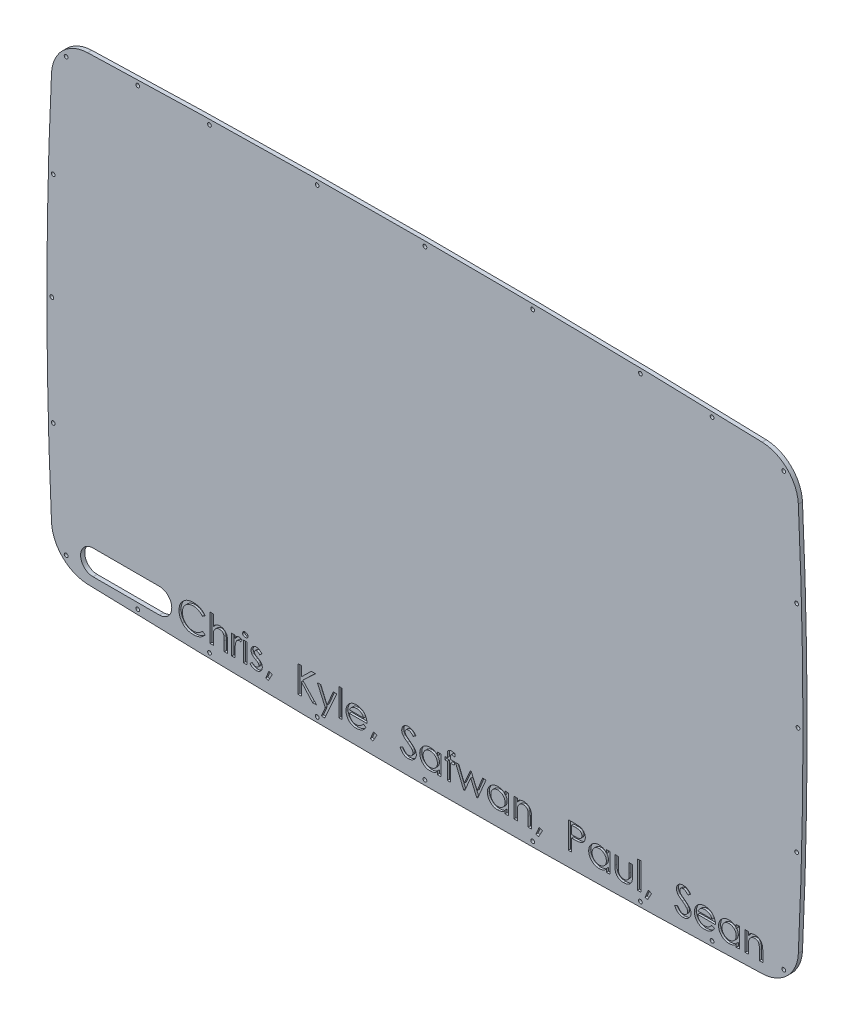
from build123d import *

# Parameters (mm, degrees)
SKETCH1_R           = 1.435
SKETCH1_R_2         = 1.4351
BOSS_EXTRUDE1_DEPTH = 3.175
CUT_EXTRUDE1_DEPTH  = 342.698968356
SKETCH3_W           = 2.605128205
SKETCH3_H           = 15.109743589
SKETCH3_H_2         = 20.841025641
CUT_EXTRUDE2_DEPTH  = 1.5875


with BuildPart() as part:
    # Sketch1 → Boss-Extrude1 (new body)
    with BuildSketch(Plane.XY):
        with BuildLine():
            ThreePointArc((2.968751211, -181.189695026), (41.295889155, -181.079537948), (79.6220041, -180.778621425))
            Line((79.6220041, -180.778621425), (85.559165015, -180.714940362))
            ThreePointArc((85.559165015, -180.714940362), (123.887667874, -180.193645916), (162.213100977, -179.481566675))
            ThreePointArc((162.213100977, -179.481566675), (165.18118139, -179.418457741), (168.149237253, -179.35420455))
            ThreePointArc((168.149237253, -179.35420455), (192.659124698, -178.779845314), (217.167059321, -178.127456184))
            ThreePointArc((217.167059321, -178.127456184), (220.135246662, -178.043143258), (223.103401271, -177.957685792))
            Line((223.103401271, -177.957685792), (258.423629847, -176.852835003))
            ThreePointArc((258.423629847, -176.852835003), (267.290868319, -175.133004675), (275.18450496, -170.742533734))
            ThreePointArc((275.18450496, -170.742533734), (277.610750544, -168.6061656), (279.781359306, -166.210504095))
            ThreePointArc((279.781359306, -166.210504095), (284.283709644, -158.379432473), (286.129131597, -149.53685032))
            ThreePointArc((286.129131597, -149.53685032), (287.482131945, -117.828809116), (288.512976487, -86.108660213))
            ThreePointArc((288.512976487, -86.108660213), (288.592974065, -83.139049998), (288.670148028, -80.169365063))
            ThreePointArc((288.670148028, -80.169365063), (289.416235277, -41.572865854), (289.685382101, -2.970094485))
            ThreePointArc((289.685382101, -2.970094485), (289.686328933, 0.0005929), (289.684451162, 2.971279842))
            ThreePointArc((289.684451162, 2.971279842), (289.409759592, 41.084465923), (288.670148028, 79.191465063))
            ThreePointArc((288.670148028, 79.191465063), (288.592974065, 82.161149998), (288.512976487, 85.130760213))
            ThreePointArc((288.512976487, 85.130760213), (287.482131945, 116.850909116), (286.129131597, 148.55895032))
            ThreePointArc((286.129131597, 148.55895032), (284.283709644, 157.401532473), (279.781359306, 165.232604095))
            ThreePointArc((279.781359306, 165.232604095), (277.610750544, 167.6282656), (275.18450496, 169.764633734))
            ThreePointArc((275.18450496, 169.764633734), (267.290868319, 174.155104675), (258.423629847, 175.874935003))
            ThreePointArc((258.423629847, 175.874935003), (240.76414932, 176.447620699), (223.103401271, 176.979785792))
            ThreePointArc((223.103401271, 176.979785792), (220.135246662, 177.065243258), (217.167059321, 177.149556184))
            ThreePointArc((217.167059321, 177.149556184), (192.659124698, 177.801945314), (168.149237253, 178.37630455))
            ThreePointArc((168.149237253, 178.37630455), (165.18118139, 178.440557741), (162.213100977, 178.503666675))
            ThreePointArc((162.213100977, 178.503666675), (123.887667874, 179.215745916), (85.559165015, 179.737040362))
            ThreePointArc((85.559165015, 179.737040362), (82.590590695, 179.769453121), (79.6220041, 179.800721425))
            ThreePointArc((79.6220041, 179.800721425), (41.295889155, 180.101637948), (2.968751211, 180.211795026))
            ThreePointArc((2.968751211, 180.211795026), (0, 180.212367286), (-2.968751211, 180.211795026))
            ThreePointArc((-2.968751211, 180.211795026), (-41.295889155, 180.101637948), (-79.6220041, 179.800721425))
            ThreePointArc((-79.6220041, 179.800721425), (-82.590590695, 179.769453121), (-85.559165015, 179.737040362))
            ThreePointArc((-85.559165015, 179.737040362), (-123.887667874, 179.215745916), (-162.213100977, 178.503666675))
            ThreePointArc((-162.213100977, 178.503666675), (-165.18118139, 178.440557741), (-168.149237253, 178.37630455))
            ThreePointArc((-168.149237253, 178.37630455), (-192.659124698, 177.801945314), (-217.167059321, 177.149556184))
            ThreePointArc((-217.167059321, 177.149556184), (-220.135246662, 177.065243258), (-223.103401271, 176.979785792))
            ThreePointArc((-223.103401271, 176.979785792), (-240.76414932, 176.447620699), (-258.423629847, 175.874935003))
            ThreePointArc((-258.423629847, 175.874935003), (-267.290868319, 174.155104675), (-275.18450496, 169.764633734))
            ThreePointArc((-275.18450496, 169.764633734), (-277.610750544, 167.6282656), (-279.781359306, 165.232604095))
            ThreePointArc((-279.781359306, 165.232604095), (-284.283709644, 157.401532473), (-286.129131597, 148.55895032))
            ThreePointArc((-286.129131597, 148.55895032), (-287.482131945, 116.850909116), (-288.512976487, 85.130760213))
            ThreePointArc((-288.512976487, 85.130760213), (-288.592974065, 82.161149998), (-288.670148028, 79.191465063))
            ThreePointArc((-288.670148028, 79.191465063), (-289.409759592, 41.084465923), (-289.684451162, 2.971279842))
            ThreePointArc((-289.684451162, 2.971279842), (-289.686328933, 0.0005929), (-289.685382101, -2.970094485))
            ThreePointArc((-289.685382101, -2.970094485), (-289.416235277, -41.572865854), (-288.670148028, -80.169365063))
            ThreePointArc((-288.670148028, -80.169365063), (-288.592974065, -83.139049998), (-288.512976487, -86.108660213))
            ThreePointArc((-288.512976487, -86.108660213), (-287.482131945, -117.828809116), (-286.129131597, -149.53685032))
            ThreePointArc((-286.129131597, -149.53685032), (-284.283709644, -158.379432473), (-279.781359306, -166.210504095))
            ThreePointArc((-279.781359306, -166.210504095), (-277.610750544, -168.6061656), (-275.18450496, -170.742533734))
            ThreePointArc((-275.18450496, -170.742533734), (-267.290868319, -175.133004675), (-258.423629847, -176.852835003))
            ThreePointArc((-258.423629847, -176.852835003), (-240.76414932, -177.425520699), (-223.103401271, -177.957685792))
            ThreePointArc((-223.103401271, -177.957685792), (-220.135246662, -178.043143258), (-217.167059321, -178.127456184))
            ThreePointArc((-217.167059321, -178.127456184), (-192.659124698, -178.779845314), (-168.149237253, -179.35420455))
            ThreePointArc((-168.149237253, -179.35420455), (-165.18118139, -179.418457741), (-162.213100977, -179.481566675))
            ThreePointArc((-162.213100977, -179.481566675), (-123.887667874, -180.193645916), (-85.559165015, -180.714940362))
            ThreePointArc((-85.559165015, -180.714940362), (-82.590590695, -180.747353121), (-79.6220041, -180.778621425))
            ThreePointArc((-79.6220041, -180.778621425), (-41.295889155, -181.079537948), (-2.968751211, -181.189695026))
            ThreePointArc((-2.968751211, -181.189695026), (0, -181.190267286), (2.968751211, -181.189695026))
        make_face()
        with Locations((-274.954150451, -165.911566346)):
            Circle(SKETCH1_R, mode=Mode.SUBTRACT)
        with Locations((-220.027075225, -174.260724966)):
            Circle(SKETCH1_R_2, mode=Mode.SUBTRACT)
        with Locations((-165.1, -175.63472853)):
            Circle(SKETCH1_R_2, mode=Mode.SUBTRACT)
        with Locations((-82.55, -176.962970799)):
            Circle(SKETCH1_R_2, mode=Mode.SUBTRACT)
        with Locations((0, -177.405667286)):
            Circle(SKETCH1_R_2, mode=Mode.SUBTRACT)
        with Locations((-284.81033356, -83.03895)):
            Circle(SKETCH1_R_2, mode=Mode.SUBTRACT)
        with Locations((82.55, -176.962970799)):
            Circle(SKETCH1_R_2, mode=Mode.SUBTRACT)
        with Locations((165.1, -175.63472853)):
            Circle(SKETCH1_R_2, mode=Mode.SUBTRACT)
        with Locations((220.027075225, -174.260724966)):
            Circle(SKETCH1_R_2, mode=Mode.SUBTRACT)
        with Locations((274.954150451, -165.911566346)):
            Circle(SKETCH1_R_2, mode=Mode.SUBTRACT)
        with Locations((284.81033356, -83.03895)):
            Circle(SKETCH1_R_2, mode=Mode.SUBTRACT)
        with Locations((-285.902364234, 0)):
            Circle(SKETCH1_R_2, mode=Mode.SUBTRACT)
        with Locations((-284.81033356, 82.06105)):
            Circle(SKETCH1_R_2, mode=Mode.SUBTRACT)
        with Locations((-274.954150451, 164.933666346)):
            Circle(SKETCH1_R_2, mode=Mode.SUBTRACT)
        with Locations((-220.027075225, 173.282824966)):
            Circle(SKETCH1_R_2, mode=Mode.SUBTRACT)
        with Locations((-165.1, 174.65682853)):
            Circle(SKETCH1_R_2, mode=Mode.SUBTRACT)
        with Locations((-82.55, 175.985070799)):
            Circle(SKETCH1_R_2, mode=Mode.SUBTRACT)
        with Locations((0, 176.427767286)):
            Circle(SKETCH1_R_2, mode=Mode.SUBTRACT)
        with Locations((285.902364234, 0)):
            Circle(SKETCH1_R_2, mode=Mode.SUBTRACT)
        with Locations((284.81033356, 82.06105)):
            Circle(SKETCH1_R_2, mode=Mode.SUBTRACT)
        with Locations((82.55, 175.985070799)):
            Circle(SKETCH1_R_2, mode=Mode.SUBTRACT)
        with Locations((165.1, 174.65682853)):
            Circle(SKETCH1_R_2, mode=Mode.SUBTRACT)
        with Locations((220.027075225, 173.282824966)):
            Circle(SKETCH1_R_2, mode=Mode.SUBTRACT)
        with Locations((274.954150451, 164.933666346)):
            Circle(SKETCH1_R_2, mode=Mode.SUBTRACT)
    extrude(amount=BOSS_EXTRUDE1_DEPTH)

    # Sketch2 → Cut-Extrude1 (cut, through all)
    with BuildSketch(Plane.XY.offset(3.175)):
        with BuildLine():
            Line((-254.317075225, -150.765724966), (-203.517075225, -150.765724966))
            ThreePointArc((-203.517075225, -150.765724966), (-193.992075225, -160.290724966), (-203.517075225, -169.815724966))
            Line((-203.517075225, -169.815724966), (-254.317075225, -169.815724966))
            ThreePointArc((-254.317075225, -169.815724966), (-263.842075225, -160.290724966), (-254.317075225, -150.765724966))
        make_face()
    extrude(amount=-CUT_EXTRUDE1_DEPTH, mode=Mode.SUBTRACT)

    # Sketch3 → Cut-Extrude2 (cut)
    # profile 1 of 28: a face of its own
    with BuildSketch(Plane.XY.offset(3.175)):
        with BuildLine():
            Line((-168.367880531, -152.717869516), (-170.443842069, -154.150690029))
            add(Edge.make_bspline(
                [(-170.443842069, -154.150690029), (-170.692482175, -153.878341728), (-171.179224867, -153.345187415), (-171.980769851, -152.64678816), (-172.819620262, -152.058975681), (-173.696957285, -151.583706966), (-174.613709804, -151.211646861), (-175.574700026, -150.953127284), (-176.580931942, -150.793807505), (-177.266781537, -150.774073776), (-177.616085659, -150.764023362)],
                knots=[0, 0, 0, 0, 1.078723025, 2.111729107, 3.104379151, 4.071093171, 5.02612831, 5.993405043, 6.978038489, 8, 8, 8, 8], degree=3))
            add(Edge.make_bspline(
                [(-177.616085659, -150.764023362), (-177.798057252, -150.766646253), (-178.160071472, -150.771864232), (-178.696533912, -150.829232257), (-179.224790775, -150.907753072), (-179.744345043, -151.027057352), (-180.254273725, -151.183025415), (-180.758051238, -151.363900948), (-181.248048467, -151.587933317), (-181.729018766, -151.836943891), (-182.193745594, -152.1170256), (-182.631476988, -152.428106236), (-183.050176875, -152.7562856), (-183.438007935, -153.117080031), (-183.798509433, -153.504157466), (-184.139578255, -153.912646865), (-184.452593891, -154.347861513), (-184.736353218, -154.808496673), (-184.995185119, -155.28768902), (-185.212400642, -155.78895059), (-185.400984832, -156.30377789), (-185.557484289, -156.834851704), (-185.673232355, -157.383780641), (-185.75905793, -157.949070511), (-185.814057736, -158.529469202), (-185.819496818, -158.922565342), (-185.822239505, -159.120786182)],
                knots=[0, 0, 0, 0, 1.002068956, 1.993515617, 2.969284448, 3.943018425, 4.926742606, 5.905741285, 6.889351865, 7.892340394, 8.888397413, 9.875523532, 10.849114049, 11.817064186, 12.790109362, 13.76151668, 14.746886598, 15.740472426, 16.740336546, 17.744438579, 18.747064952, 19.759451636, 20.791569268, 21.834966327, 22.908270136, 24, 24, 24, 24], degree=3))
            add(Edge.make_bspline(
                [(-185.822239505, -159.120786182), (-185.815960381, -159.418338056), (-185.803668804, -160.000804886), (-185.684863936, -160.853682859), (-185.499486395, -161.666445858), (-185.238901492, -162.439029701), (-184.902194928, -163.170556725), (-184.490262932, -163.859825117), (-184.000735128, -164.508515514), (-183.441726793, -165.108243112), (-182.832354901, -165.658638306), (-182.171905811, -166.129550319), (-181.48299551, -166.538475342), (-180.752008253, -166.863158027), (-179.989273478, -167.12138294), (-179.188888045, -167.304299531), (-178.353338208, -167.416531102), (-177.783330692, -167.430004299), (-177.493970274, -167.436843875)],
                knots=[0, 0, 0, 0, 1.083728652, 2.12143175, 3.131304262, 4.117911469, 5.086904967, 6.060353746, 7.03835, 8.042493243, 9.043967071, 10.025107856, 10.993520914, 11.958418665, 12.934074928, 13.923564625, 14.94591178, 16, 16, 16, 16], degree=3))
            add(Edge.make_bspline(
                [(-177.493970274, -167.436843875), (-177.158187107, -167.426973432), (-176.494993781, -167.407478674), (-175.519850524, -167.243273474), (-174.580275526, -166.978053072), (-173.675254332, -166.604175023), (-172.804048252, -166.125312992), (-171.970750054, -165.537785046), (-171.170715565, -164.846903893), (-170.684428683, -164.319788137), (-170.435701043, -164.050177208)],
                knots=[0, 0, 0, 0, 0.996377973, 1.967910503, 2.926842387, 3.889624876, 4.868586907, 5.872161968, 6.91164629, 8, 8, 8, 8], degree=3))
            Line((-170.435701043, -164.050177208), (-168.367880531, -165.474856695))
            add(Edge.make_bspline(
                [(-168.367880531, -165.474856695), (-168.501742368, -165.644616167), (-168.767708433, -165.981906166), (-169.197223735, -166.458989784), (-169.648375693, -166.907685041), (-170.125606994, -167.323830018), (-170.628407058, -167.707019946), (-171.154420036, -168.061691759), (-171.703140459, -168.387281341), (-172.274268546, -168.680304658), (-172.864550631, -168.942564299), (-173.47519188, -169.163417627), (-174.100339915, -169.358246447), (-174.74550694, -169.510775845), (-175.408174381, -169.63439663), (-176.089368558, -169.717371605), (-176.786110902, -169.773532337), (-177.256410185, -169.778798956), (-177.493970274, -169.781459259)],
                knots=[0, 0, 0, 0, 0.990136069, 1.967271632, 2.938597646, 3.903378639, 4.8655934, 5.832714132, 6.808088679, 7.786607084, 8.77175572, 9.76479442, 10.759640537, 11.769709565, 12.799869661, 13.846050076, 14.911985293, 16, 16, 16, 16], degree=3))
            add(Edge.make_bspline(
                [(-177.493970274, -169.781459259), (-177.712520989, -169.779978135), (-178.143324081, -169.777058569), (-178.779986273, -169.72800447), (-179.399777244, -169.661671953), (-180.001026367, -169.562157066), (-180.586570734, -169.442986557), (-181.151630937, -169.284980659), (-181.703873254, -169.108727702), (-182.235262524, -168.895574378), (-182.749805392, -168.658537419), (-183.24931196, -168.39874903), (-183.728868083, -168.105626937), (-184.188872943, -167.782018106), (-184.63474114, -167.436069147), (-185.061963223, -167.060077389), (-185.474984305, -166.658830778), (-185.730437235, -166.369367631), (-185.85887412, -166.223831054)],
                knots=[0, 0, 0, 0, 1.116169561, 2.200172621, 3.260333751, 4.299600589, 5.312386579, 6.311224183, 7.295427787, 8.272379731, 9.233840239, 10.188782295, 11.146938977, 12.102635432, 13.060741968, 14.028403985, 15.00871894, 16, 16, 16, 16], degree=3))
            add(Edge.make_bspline(
                [(-185.85887412, -166.223831054), (-186.064763218, -165.971142247), (-186.472869661, -165.470270992), (-186.993007821, -164.65613127), (-187.441640318, -163.808780371), (-187.798096607, -162.916145666), (-188.079846855, -161.98875445), (-188.285203623, -161.023776905), (-188.403527475, -160.017912166), (-188.419332184, -159.334118033), (-188.42736771, -158.986459259)],
                knots=[0, 0, 0, 0, 0.995996121, 1.974230005, 2.94855815, 3.923972302, 4.908363682, 5.909282248, 6.937024559, 8, 8, 8, 8], degree=3))
            add(Edge.make_bspline(
                [(-188.42736771, -158.986459259), (-188.418295962, -158.620974695), (-188.400447864, -157.901906632), (-188.250133698, -156.846339047), (-188.005215294, -155.836586171), (-187.668581401, -154.868290693), (-187.222506999, -153.949374718), (-186.690538474, -153.067963974), (-186.047204791, -152.240481398), (-185.324164073, -151.459761277), (-184.528667912, -150.745262812), (-183.669592105, -150.125677083), (-182.765282053, -149.596210084), (-181.812407441, -149.162479735), (-180.808386344, -148.826477291), (-179.754878597, -148.594029213), (-178.654143066, -148.446842137), (-177.904209453, -148.428662251), (-177.522463864, -148.419407977)],
                knots=[0, 0, 0, 0, 1.034323922, 2.034967744, 3.011348252, 3.972313581, 4.931003742, 5.898099022, 6.881526582, 7.89265862, 8.907395938, 9.903191422, 10.886146247, 11.869423756, 12.861842533, 13.877618994, 14.91962492, 16, 16, 16, 16], degree=3))
            add(Edge.make_bspline(
                [(-177.522463864, -148.419407977), (-177.28220627, -148.422189926), (-176.806518674, -148.427697924), (-176.101257328, -148.482119509), (-175.413893476, -148.571447497), (-174.744289846, -148.69449252), (-174.090464528, -148.846539388), (-173.455877866, -149.044795592), (-172.836934074, -149.271277989), (-172.237799436, -149.532763427), (-171.659944156, -149.823653511), (-171.109919471, -150.151814792), (-170.583924823, -150.504652335), (-170.086152865, -150.889520414), (-169.613285859, -151.30007332), (-169.16763319, -151.741036509), (-168.75151679, -152.214198346), (-168.496187448, -152.549416995), (-168.367880531, -152.717869516)],
                knots=[0, 0, 0, 0, 1.097463626, 2.172875475, 3.229307817, 4.262776093, 5.282168658, 6.293918414, 7.298043722, 8.291879901, 9.278790577, 10.251524626, 11.216027204, 12.170719329, 13.124142787, 14.075306658, 15.032812027, 16, 16, 16, 16], degree=3))
        make_face()
    # profile 2 of 28: a face of its own
    with BuildSketch(Plane.XY.offset(3.175)):
        with BuildLine():
            Line((-164.720701043, -148.419407977), (-162.115572838, -148.419407977))
            Line((-162.115572838, -148.419407977), (-162.115572838, -156.898286182))
            add(Edge.make_bspline(
                [(-162.115572838, -156.898286182), (-162.074493536, -156.779319755), (-161.993575081, -156.5449784), (-161.83249735, -156.211933588), (-161.639078963, -155.900423062), (-161.417586156, -155.609325621), (-161.164031917, -155.340629586), (-160.882739985, -155.091769511), (-160.569393619, -154.863785166), (-160.111553253, -154.595819016), (-159.50612983, -154.307602605), (-158.736182146, -154.071862626), (-157.937317478, -153.916395327), (-157.393163346, -153.899004007), (-157.116983095, -153.890177208)],
                knots=[0, 0, 0, 0, 0.726002409, 1.430087388, 2.129934406, 2.839529794, 3.537665638, 4.258963741, 5.004638702, 5.770241878, 7.318835169, 8.862032232, 10.407354324, 12, 12, 12, 12], degree=3))
            add(Edge.make_bspline(
                [(-157.116983095, -153.890177208), (-156.964869304, -153.891658656), (-156.664017617, -153.894588675), (-156.219991523, -153.944040826), (-155.787634136, -154.008687163), (-155.372658289, -154.113828991), (-154.968555348, -154.238567211), (-154.581020433, -154.398935868), (-154.202704822, -154.580016804), (-153.847183638, -154.798655614), (-153.506273785, -155.032183214), (-153.187806732, -155.285061406), (-152.894386681, -155.554631145), (-152.622458819, -155.838622243), (-152.385698373, -156.147340153), (-152.160419982, -156.463356921), (-151.973686847, -156.804015323), (-151.795592264, -157.157916477), (-151.649935765, -157.548968605), (-151.518497265, -157.979113671), (-151.416194075, -158.459172691), (-151.325772796, -158.984428562), (-151.257952733, -159.557867125), (-151.211381948, -160.178538661), (-151.175905498, -160.846280351), (-151.174672361, -161.307956217), (-151.174034377, -161.546811823)],
                knots=[0, 0, 0, 0, 0.98884413, 1.955742631, 2.903232429, 3.830109511, 4.737279817, 5.651804753, 6.555706277, 7.462361242, 8.363284783, 9.242681743, 10.104723419, 10.953836925, 11.796042086, 12.633330979, 13.475166102, 14.319864776, 15.208250695, 16.185486364, 17.24329447, 18.398260912, 19.65171094, 20.997406669, 22.446558932, 24, 24, 24, 24], degree=3))
            Line((-151.174034377, -161.546811823), (-151.174034377, -169.260433618))
            Line((-151.174034377, -169.260433618), (-153.779162582, -169.260433618))
            Line((-153.779162582, -169.260433618), (-153.779162582, -162.149247721))
            add(Edge.make_bspline(
                [(-153.779162582, -162.149247721), (-153.780321862, -161.955220767), (-153.782543236, -161.583432473), (-153.788835503, -161.051436997), (-153.806549773, -160.569786923), (-153.824987246, -160.139449995), (-153.852613963, -159.759226084), (-153.890076989, -159.429619352), (-153.927946492, -159.149386257), (-153.962889464, -158.980890802), (-153.97861771, -158.905049003)],
                knots=[0, 0, 0, 0, 1.43046958, 2.741020424, 3.922057026, 4.983558129, 5.916472262, 6.731704614, 7.42912523, 8, 8, 8, 8], degree=3))
            add(Edge.make_bspline(
                [(-153.97861771, -158.905049003), (-154.039056978, -158.69399859), (-154.155195338, -158.288450186), (-154.420153067, -157.735243814), (-154.759624141, -157.270062955), (-155.165454819, -156.886866126), (-155.641471319, -156.589847643), (-156.187358864, -156.382140033), (-156.800364764, -156.254213297), (-157.23300325, -156.241454579), (-157.458906172, -156.234792593)],
                knots=[0, 0, 0, 0, 1.09702437, 2.108010487, 3.050275249, 3.962726502, 4.88374792, 5.8380153, 6.871116009, 8, 8, 8, 8], degree=3))
            add(Edge.make_bspline(
                [(-157.458906172, -156.234792593), (-157.581207433, -156.237770471), (-157.824079833, -156.243684103), (-158.183236315, -156.295754801), (-158.535287229, -156.371372946), (-158.879602158, -156.483272508), (-159.217648902, -156.625560824), (-159.548662403, -156.801366401), (-159.870338244, -157.011584631), (-160.185503395, -157.24530329), (-160.48733397, -157.502798783), (-160.758207691, -157.790103279), (-161.009126781, -158.091942444), (-161.233185928, -158.415005749), (-161.432838742, -158.756173138), (-161.605072367, -159.118583923), (-161.75141941, -159.499925076), (-161.828422802, -159.764682263), (-161.867271556, -159.898254131)],
                knots=[0, 0, 0, 0, 0.952676093, 1.891875259, 2.823242897, 3.756289973, 4.708848676, 5.678626492, 6.672999903, 7.700884102, 8.735491531, 9.760161285, 10.77429995, 11.792235766, 12.820609421, 13.85175227, 14.916193867, 16, 16, 16, 16], degree=3))
            add(Edge.make_bspline(
                [(-161.867271556, -159.898254131), (-161.887079673, -159.987640017), (-161.930972951, -160.185712341), (-161.983297768, -160.514334288), (-162.020155168, -160.90333939), (-162.059851754, -161.352173733), (-162.079644853, -161.862896363), (-162.101918057, -162.432663813), (-162.113380027, -163.062355562), (-162.114818268, -163.502012117), (-162.115572838, -163.732677208)],
                knots=[0, 0, 0, 0, 0.570762336, 1.264765918, 2.072876171, 3.006551002, 4.073679124, 5.25879008, 6.561828709, 8, 8, 8, 8], degree=3))
            Line((-162.115572838, -163.732677208), (-162.115572838, -169.260433618))
            Line((-162.115572838, -169.260433618), (-164.720701043, -169.260433618))
            Line((-164.720701043, -169.260433618), (-164.720701043, -148.419407977))
        make_face()
    # profile 3 of 28: a face of its own
    with BuildSketch(Plane.XY.offset(3.175)):
        with BuildLine():
            Line((-148.047880531, -154.150690029), (-145.442752326, -154.150690029))
            Line((-145.442752326, -154.150690029), (-145.442752326, -156.295850285))
            add(Edge.make_bspline(
                [(-145.442752326, -156.295850285), (-145.427032956, -156.197773776), (-145.396350975, -156.006342339), (-145.318957335, -155.731246327), (-145.211911959, -155.475841248), (-145.077362774, -155.239836499), (-144.917796353, -155.022335677), (-144.731593365, -154.824697519), (-144.519619983, -154.644153714), (-144.198922305, -154.437794727), (-143.777867237, -154.219531984), (-143.249556016, -154.030112941), (-142.708705663, -153.910115406), (-142.341631739, -153.896829217), (-142.157848479, -153.890177208)],
                knots=[0, 0, 0, 0, 0.801625561, 1.56465941, 2.301277113, 3.032414989, 3.753384473, 4.4742707, 5.220602463, 5.995500889, 7.548895402, 9.039144265, 10.517585467, 12, 12, 12, 12], degree=3))
            add(Edge.make_bspline(
                [(-142.157848479, -153.890177208), (-141.991625112, -153.900048153), (-141.642410323, -153.92078579), (-141.106000436, -154.059050846), (-140.541163755, -154.287249478), (-140.168079925, -154.491231381), (-139.971983095, -154.598446439)],
                knots=[0, 0, 0, 0, 0.858860638, 1.804360244, 2.845948385, 4, 4, 4, 4], degree=3))
            Line((-139.971983095, -154.598446439), (-141.205348479, -156.4912349))
            add(Edge.make_bspline(
                [(-141.205348479, -156.4912349), (-141.346034555, -156.451437541), (-141.603041789, -156.378735186), (-141.957302339, -156.304670039), (-142.23759399, -156.248536854), (-142.401915879, -156.238872165), (-142.471277967, -156.234792593)],
                knots=[0, 0, 0, 0, 1.354987806, 2.475310119, 3.356411532, 4, 4, 4, 4], degree=3))
            add(Edge.make_bspline(
                [(-142.471277967, -156.234792593), (-142.584932991, -156.243127129), (-142.824149265, -156.260669308), (-143.180992774, -156.398545181), (-143.547372855, -156.611265984), (-143.8492227, -156.849452009), (-144.091379335, -157.082265446), (-144.26462959, -157.295822267), (-144.43277582, -157.537514961), (-144.590626987, -157.809791052), (-144.736302874, -158.112879442), (-144.874072299, -158.443284367), (-145.006411792, -158.802254116), (-145.079377788, -159.055138293), (-145.1171113, -159.185914388)],
                knots=[0, 0, 0, 0, 0.965356871, 2.031842204, 3.216327082, 4.56533618, 5.292082419, 6.07124699, 6.900886396, 7.796081313, 8.746333432, 9.760722644, 10.841983902, 12, 12, 12, 12], degree=3))
            add(Edge.make_bspline(
                [(-145.1171113, -159.185914388), (-145.144663401, -159.294099879), (-145.206480665, -159.53683023), (-145.264679117, -159.948889129), (-145.323275196, -160.441267878), (-145.364494477, -161.015935963), (-145.4024848, -161.671252501), (-145.424094041, -162.409656237), (-145.442013398, -163.230558451), (-145.442498405, -163.805933418), (-145.442752326, -164.107164388)],
                knots=[0, 0, 0, 0, 0.541796663, 1.215601946, 2.018210726, 2.950106988, 4.012619945, 5.205915212, 6.537188929, 8, 8, 8, 8], degree=3))
            Line((-145.442752326, -164.107164388), (-145.442752326, -169.260433618))
            Line((-145.442752326, -169.260433618), (-148.047880531, -169.260433618))
            Line((-148.047880531, -169.260433618), (-148.047880531, -154.150690029))
        make_face()
    # profile 4 of 28: a face of its own
    with BuildSketch(Plane.XY.offset(3.175)):
        with BuildLine():
            add(Edge.make_bspline(
                [(-137.765765146, -148.158895157), (-137.609117092, -148.165755217), (-137.30688993, -148.178990597), (-136.876134409, -148.285435001), (-136.491098775, -148.468491825), (-136.16309024, -148.720699311), (-135.891252563, -149.009580916), (-135.689989612, -149.321621131), (-135.568965511, -149.652444893), (-135.551790387, -149.878445628), (-135.543265146, -149.990625926)],
                knots=[0, 0, 0, 0, 1.180073081, 2.27676073, 3.320042968, 4.371717959, 5.377874923, 6.297457691, 7.154906711, 8, 8, 8, 8], degree=3))
            add(Edge.make_bspline(
                [(-135.543265146, -149.990625926), (-135.551806994, -150.101447776), (-135.569022399, -150.324800275), (-135.689967724, -150.651821165), (-135.892781045, -150.959679853), (-136.161649261, -151.248808358), (-136.492569946, -151.49588974), (-136.875929062, -151.679799053), (-137.306946993, -151.78590577), (-137.609136572, -151.799189515), (-137.765765146, -151.806074644)],
                knots=[0, 0, 0, 0, 0.838561902, 1.690053866, 2.604955955, 3.615478493, 4.665551833, 5.713360726, 6.814806749, 8, 8, 8, 8], degree=3))
            add(Edge.make_bspline(
                [(-137.765765146, -151.806074644), (-137.895507573, -151.800807723), (-138.148439004, -151.790539919), (-138.510030326, -151.680605412), (-138.846875557, -151.518256835), (-139.144167065, -151.285186494), (-139.395089602, -151.009889206), (-139.581470631, -150.696562656), (-139.690093019, -150.351767416), (-139.704278141, -150.112127846), (-139.711470274, -149.990625926)],
                knots=[0, 0, 0, 0, 1.050897616, 2.04871332, 3.044517726, 4.074156936, 5.096691018, 6.055190702, 7.01394389, 8, 8, 8, 8], degree=3))
            add(Edge.make_bspline(
                [(-139.711470274, -149.990625926), (-139.704578281, -149.866344256), (-139.691130963, -149.623851974), (-139.580407556, -149.275800964), (-139.396464703, -148.959757119), (-139.144171368, -148.683588402), (-138.845781824, -148.451730901), (-138.510090441, -148.282504102), (-138.146713458, -148.175650969), (-137.894043105, -148.164537396), (-137.765765146, -148.158895157)],
                knots=[0, 0, 0, 0, 1.003476519, 1.957934027, 2.921620235, 3.939572868, 4.964598795, 5.960849032, 6.964745478, 8, 8, 8, 8], degree=3))
        make_face()
    # profile 5 of 28: a face of its own
    with BuildSketch(Plane.XY.offset(3.175)):
        with Locations((-137.62736771, -161.705561824)):
            Rectangle(SKETCH3_W, SKETCH3_H)
    # profile 6 of 28: a face of its own
    with BuildSketch(Plane.XY.offset(3.175)):
        with BuildLine():
            Line((-124.862239505, -156.287709259), (-126.527079249, -157.797869516))
            add(Edge.make_bspline(
                [(-126.527079249, -157.797869516), (-126.648934489, -157.674048043), (-126.883461616, -157.435736634), (-127.246266172, -157.120555666), (-127.592534065, -156.847006961), (-127.930564554, -156.626677093), (-128.256927406, -156.452791938), (-128.572079716, -156.32911303), (-128.875971896, -156.250160864), (-129.076152494, -156.239800446), (-129.172912582, -156.234792593)],
                knots=[0, 0, 0, 0, 1.323954473, 2.548132, 3.661338868, 4.685637623, 5.620299102, 6.475132344, 7.262933916, 8, 8, 8, 8], degree=3))
            add(Edge.make_bspline(
                [(-129.172912582, -156.234792593), (-129.257854049, -156.240001879), (-129.429795751, -156.250546712), (-129.679189167, -156.348002313), (-129.918278265, -156.499424253), (-130.147253147, -156.69947795), (-130.347437326, -156.94898082), (-130.490428551, -157.243898783), (-130.579523472, -157.574279059), (-130.588720521, -157.806764221), (-130.593521556, -157.928125926)],
                knots=[0, 0, 0, 0, 0.832490187, 1.685157841, 2.595972223, 3.607628721, 4.662023247, 5.718189086, 6.808851023, 8, 8, 8, 8], degree=3))
            add(Edge.make_bspline(
                [(-130.593521556, -157.928125926), (-130.589287872, -158.037201844), (-130.581035129, -158.249824127), (-130.50328417, -158.55407855), (-130.388323785, -158.83939118), (-130.267583045, -159.002214299), (-130.206822838, -159.084151567)],
                knots=[0, 0, 0, 0, 1.051456026, 2.049608974, 3.018507243, 4, 4, 4, 4], degree=3))
            add(Edge.make_bspline(
                [(-130.206822838, -159.084151567), (-130.101312557, -159.201328729), (-129.870938959, -159.457176064), (-129.423232988, -159.800619612), (-128.876798154, -160.163994743), (-128.465223171, -160.391225507), (-128.244835659, -160.512901567)],
                knots=[0, 0, 0, 0, 0.773884963, 1.689718389, 2.762905336, 4, 4, 4, 4], degree=3))
            add(Edge.make_bspline(
                [(-128.244835659, -160.512901567), (-128.07055427, -160.608158981), (-127.735568016, -160.791253256), (-127.262952991, -161.072061081), (-126.836722614, -161.346446581), (-126.454096056, -161.612167444), (-126.119877477, -161.876272355), (-125.833877224, -162.133944469), (-125.588615846, -162.380701806), (-125.454930626, -162.554922965), (-125.391406172, -162.637709259)],
                knots=[0, 0, 0, 0, 1.33001518, 2.556422155, 3.680542608, 4.724184501, 5.674971885, 6.530695486, 7.30181686, 8, 8, 8, 8], degree=3))
            add(Edge.make_bspline(
                [(-125.391406172, -162.637709259), (-125.270056736, -162.827121919), (-125.032685176, -163.197631912), (-124.78471097, -163.798693038), (-124.629599143, -164.414076616), (-124.611021189, -164.830817419), (-124.601726684, -165.039311823)],
                knots=[0, 0, 0, 0, 1.049962625, 2.053831286, 3.026336549, 4, 4, 4, 4], degree=3))
            add(Edge.make_bspline(
                [(-124.601726684, -165.039311823), (-124.60512315, -165.187477431), (-124.61182573, -165.479867281), (-124.680522862, -165.909187766), (-124.785179394, -166.324623714), (-124.938283537, -166.724660249), (-125.129350225, -167.112399069), (-125.364039899, -167.485966493), (-125.641648143, -167.844909015), (-125.961345482, -168.183523899), (-126.312401576, -168.494717111), (-126.689768808, -168.77123871), (-127.092523375, -169.00326614), (-127.522044812, -169.19065792), (-127.972861774, -169.344859098), (-128.453428788, -169.441280308), (-128.955111945, -169.511490822), (-129.2988338, -169.517752837), (-129.474130531, -169.520946439)],
                knots=[0, 0, 0, 0, 0.963489602, 1.901349341, 2.822262455, 3.747230613, 4.683134612, 5.631288318, 6.613293617, 7.631511985, 8.657397281, 9.662358437, 10.671075458, 11.675221639, 12.708377436, 13.76481686, 14.860065804, 16, 16, 16, 16], degree=3))
            add(Edge.make_bspline(
                [(-129.474130531, -169.520946439), (-129.688945887, -169.513670568), (-130.117096224, -169.499168967), (-130.750596434, -169.389350233), (-131.370778101, -169.213758516), (-131.971625432, -168.96645788), (-132.545544938, -168.646076103), (-133.072365376, -168.240226363), (-133.563204532, -167.769037912), (-133.839748073, -167.402950422), (-133.980188223, -167.217036182)],
                knots=[0, 0, 0, 0, 0.979216887, 1.951685614, 2.923149898, 3.913640395, 4.908296688, 5.910698089, 6.938966812, 8, 8, 8, 8], degree=3))
            Line((-133.980188223, -167.217036182), (-132.44560489, -165.613254131))
            add(Edge.make_bspline(
                [(-132.44560489, -165.613254131), (-132.315550864, -165.73710642), (-132.064684583, -165.976009927), (-131.677407708, -166.292903193), (-131.303024214, -166.563513016), (-130.939471353, -166.786502308), (-130.585007373, -166.958795405), (-130.240265471, -167.083258733), (-129.905004126, -167.161038111), (-129.683458672, -167.171332767), (-129.575893351, -167.176331054)],
                knots=[0, 0, 0, 0, 1.288506075, 2.485449601, 3.588003455, 4.601705531, 5.542438646, 6.411005369, 7.228507225, 8, 8, 8, 8], degree=3))
            add(Edge.make_bspline(
                [(-129.575893351, -167.176331054), (-129.416465083, -167.168255889), (-129.105559105, -167.152508261), (-128.656733269, -167.036411255), (-128.247563398, -166.83802778), (-127.888667704, -166.565151774), (-127.58941082, -166.244875089), (-127.366211197, -165.889758078), (-127.233429565, -165.502896742), (-127.215788656, -165.235689483), (-127.20685489, -165.100369516)],
                knots=[0, 0, 0, 0, 1.096025125, 2.137392371, 3.164312155, 4.204088696, 5.221248568, 6.164137697, 7.070276657, 8, 8, 8, 8], degree=3))
            add(Edge.make_bspline(
                [(-127.20685489, -165.100369516), (-127.212380377, -164.989918748), (-127.223246876, -164.772704762), (-127.308567889, -164.456825266), (-127.447523093, -164.157611995), (-127.581875383, -163.981457223), (-127.650540787, -163.891427208)],
                knots=[0, 0, 0, 0, 1.00762038, 1.981599971, 2.968426558, 4, 4, 4, 4], degree=3))
            add(Edge.make_bspline(
                [(-127.650540787, -163.891427208), (-127.694451321, -163.843068247), (-127.790743954, -163.737020533), (-127.968611217, -163.58412593), (-128.182937061, -163.419930883), (-128.433410912, -163.241372844), (-128.727601621, -163.062393521), (-129.056623652, -162.864679447), (-129.42796801, -162.663578797), (-129.688380949, -162.526189237), (-129.824194633, -162.454536182)],
                knots=[0, 0, 0, 0, 0.598311898, 1.312054841, 2.145484848, 3.073753233, 4.129800786, 5.300877464, 6.592321185, 8, 8, 8, 8], degree=3))
            add(Edge.make_bspline(
                [(-129.824194633, -162.454536182), (-129.979615089, -162.368973011), (-130.281220269, -162.202931189), (-130.707171628, -161.940824682), (-131.100794531, -161.687190498), (-131.450765985, -161.4264717), (-131.762094917, -161.16399015), (-132.037614966, -160.905616362), (-132.279834097, -160.649815143), (-132.410828664, -160.466914751), (-132.474098479, -160.378574644)],
                knots=[0, 0, 0, 0, 1.253912045, 2.433311408, 3.534624239, 4.562802555, 5.515759338, 6.411389838, 7.23270809, 8, 8, 8, 8], degree=3))
            add(Edge.make_bspline(
                [(-132.474098479, -160.378574644), (-132.58664175, -160.201536677), (-132.811018307, -159.848577594), (-133.02853133, -159.255305383), (-133.175999539, -158.63145893), (-133.191011027, -158.200393991), (-133.198649761, -157.981042593)],
                knots=[0, 0, 0, 0, 0.987528248, 1.968826629, 2.966418566, 4, 4, 4, 4], degree=3))
            add(Edge.make_bspline(
                [(-133.198649761, -157.981042593), (-133.196576093, -157.836951867), (-133.192509098, -157.554353035), (-133.12954063, -157.142784607), (-133.048950093, -156.746891992), (-132.918418933, -156.372563786), (-132.76297044, -156.010691205), (-132.559619147, -155.674941968), (-132.330950533, -155.351599768), (-132.063724075, -155.053637182), (-131.767304233, -154.783542597), (-131.455317804, -154.541078303), (-131.121729938, -154.339503206), (-130.768689813, -154.177286948), (-130.399052251, -154.04448017), (-130.008982322, -153.958543644), (-129.603654481, -153.896565987), (-129.32648685, -153.892335081), (-129.18512412, -153.890177208)],
                knots=[0, 0, 0, 0, 1.077691122, 2.11362841, 3.112019185, 4.098344371, 5.07626173, 6.055497571, 7.031037172, 8.038433535, 9.045112416, 10.030652415, 10.992446082, 11.956062447, 12.936088526, 13.926799257, 14.942613481, 16, 16, 16, 16], degree=3))
            add(Edge.make_bspline(
                [(-129.18512412, -153.890177208), (-129.00270386, -153.896978932), (-128.634342364, -153.910713663), (-128.084793739, -154.03237187), (-127.536987038, -154.220177865), (-126.991528636, -154.483493453), (-126.453099554, -154.826603058), (-125.913905427, -155.240631842), (-125.376089386, -155.729542518), (-125.037164318, -156.097698098), (-124.862239505, -156.287709259)],
                knots=[0, 0, 0, 0, 0.858658356, 1.733890061, 2.639692681, 3.583355905, 4.58026951, 5.642917418, 6.783470838, 8, 8, 8, 8], degree=3))
        make_face()
    # profile 7 of 28: a face of its own
    with BuildSketch(Plane.XY.offset(3.175)):
        Polygon((-119.550220274, -165.09222849), (-117.04685489, -166.146491311), (-120.071245915, -171.605049003), (-121.996598479, -170.917132336), align=None)
    # profile 8 of 28: a face of its own
    with BuildSketch(Plane.XY.offset(3.175)):
        Polygon((-97.247880531, -148.940433618), (-94.642752326, -148.940433618), (-94.642752326, -156.397613106), (-87.059386941, -148.940433618), (-83.831470274, -148.940433618), (-93.576277967, -158.066523362), (-83.049931813, -169.260433618), (-86.119098479, -169.260433618), (-94.642752326, -159.735433618), (-94.642752326, -169.260433618), (-97.247880531, -169.260433618), align=None)
    # profile 9 of 28: a face of its own
    with BuildSketch(Plane.XY.offset(3.175)):
        Polygon((-82.398649761, -154.150690029), (-79.765027967, -154.150690029), (-75.002527967, -165.312036182), (-70.21560489, -154.150690029), (-67.549418992, -154.150690029), (-76.785412582, -174.731202849), (-79.42310489, -174.731202849), (-76.370220274, -167.758414388), align=None)
    # profile 10 of 28: a face of its own
    with BuildSketch(Plane.XY.offset(3.175)):
        with Locations((-64.683777967, -158.839920798)):
            Rectangle(SKETCH3_W, SKETCH3_H_2)
    # profile 11 of 28: a face of its own
    with BuildSketch(Plane.XY.offset(3.175)):
        with BuildLine():
            Line((-47.314899761, -164.050177208), (-45.145316428, -165.088157977))
            add(Edge.make_bspline(
                [(-45.145316428, -165.088157977), (-45.282479981, -165.337435468), (-45.549593795, -165.822881198), (-46.00538838, -166.493226137), (-46.500040799, -167.082757005), (-47.028743181, -167.597998418), (-47.598091533, -168.038828765), (-48.197838375, -168.429918122), (-48.840704287, -168.757844512), (-49.518438352, -169.038145137), (-50.239937064, -169.253846876), (-51.00431215, -169.407084502), (-51.813125588, -169.502541009), (-52.367493469, -169.514713734), (-52.651342069, -169.520946439)],
                knots=[0, 0, 0, 0, 1.110387997, 2.162381809, 3.158716456, 4.110235088, 5.03849693, 5.965639636, 6.901458115, 7.851707839, 8.825366416, 9.836184406, 10.892078622, 12, 12, 12, 12], degree=3))
            add(Edge.make_bspline(
                [(-52.651342069, -169.520946439), (-52.951619503, -169.514760192), (-53.53816951, -169.502676224), (-54.390747654, -169.383894498), (-55.195234503, -169.204146984), (-55.948715799, -168.943816058), (-56.648283225, -168.601897593), (-57.302284281, -168.193637588), (-57.903032701, -167.70634745), (-58.444791669, -167.148232858), (-58.926037052, -166.545462301), (-59.356143716, -165.921782943), (-59.707939606, -165.2709374), (-60.005066757, -164.605487683), (-60.233785651, -163.918256716), (-60.395834942, -163.212257184), (-60.497597757, -162.485993111), (-60.509531064, -161.994903314), (-60.515572838, -161.746266952)],
                knots=[0, 0, 0, 0, 1.164566152, 2.274817246, 3.333639364, 4.359360714, 5.360157823, 6.349126428, 7.344925074, 8.35392925, 9.361228562, 10.335284257, 11.289572886, 12.22779236, 13.160187688, 14.095091993, 15.035554391, 16, 16, 16, 16], degree=3))
            add(Edge.make_bspline(
                [(-60.515572838, -161.746266952), (-60.510282901, -161.513964951), (-60.499790439, -161.053199595), (-60.410299761, -160.37271691), (-60.273876022, -159.710256), (-60.077360655, -159.068525383), (-59.82302947, -158.44639558), (-59.512790751, -157.843001268), (-59.146432777, -157.258511166), (-58.863357046, -156.891977307), (-58.720476684, -156.70697208)],
                knots=[0, 0, 0, 0, 1.021096707, 2.025320431, 3.012923591, 3.992437812, 4.971861174, 5.964497656, 6.972595394, 8, 8, 8, 8], degree=3))
            add(Edge.make_bspline(
                [(-58.720476684, -156.70697208), (-58.527258419, -156.482502601), (-58.146417933, -156.040064797), (-57.497391108, -155.464600667), (-56.801843755, -154.974969843), (-56.055193069, -154.579725156), (-55.262974893, -154.265687234), (-54.420665326, -154.048561207), (-53.530752934, -153.915340108), (-52.921829359, -153.898687552), (-52.610636941, -153.890177208)],
                knots=[0, 0, 0, 0, 1.018725525, 2.007946416, 2.977291296, 3.940674949, 4.909614547, 5.904411593, 6.929042575, 8, 8, 8, 8], degree=3))
            add(Edge.make_bspline(
                [(-52.610636941, -153.890177208), (-52.274972273, -153.897911561), (-51.619631903, -153.91301185), (-50.666234101, -154.055918799), (-49.766977832, -154.281649743), (-48.924120952, -154.604839378), (-48.135959449, -155.019276882), (-47.402703586, -155.523270084), (-46.722953303, -156.119777225), (-46.329755636, -156.582332367), (-46.130380531, -156.816875926)],
                knots=[0, 0, 0, 0, 1.092510559, 2.132980742, 3.131821249, 4.106721871, 5.065344059, 6.025034973, 6.998572742, 8, 8, 8, 8], degree=3))
            add(Edge.make_bspline(
                [(-46.130380531, -156.816875926), (-45.990785183, -156.99870776), (-45.71248893, -157.36120636), (-45.363839983, -157.955189924), (-45.060609818, -158.579011066), (-44.810811005, -159.240792318), (-44.622973646, -159.939743573), (-44.477682124, -160.670863846), (-44.393902468, -161.437745761), (-44.376638229, -161.960458504), (-44.367848479, -162.226587465)],
                knots=[0, 0, 0, 0, 0.947891001, 1.889708495, 2.844047414, 3.816063809, 4.811874475, 5.836031954, 6.898258033, 8, 8, 8, 8], degree=3))
            Line((-44.367848479, -162.226587465), (-57.914515146, -162.226587465))
            add(Edge.make_bspline(
                [(-57.914515146, -162.226587465), (-57.907526669, -162.399282888), (-57.893802887, -162.738417476), (-57.807323487, -163.233703404), (-57.687327259, -163.708815999), (-57.519171672, -164.163017981), (-57.306296214, -164.596596133), (-57.049543303, -165.009266216), (-56.745029252, -165.397892877), (-56.401328258, -165.761386202), (-56.026319352, -166.092107496), (-55.630105862, -166.382679636), (-55.215671276, -166.630995312), (-54.780426357, -166.828064624), (-54.328556988, -166.986208277), (-53.85866986, -167.092990007), (-53.371481989, -167.167530567), (-53.039689339, -167.173366563), (-52.871149761, -167.176331054)],
                knots=[0, 0, 0, 0, 1.056285998, 2.074305788, 3.068874036, 4.051103373, 5.031155672, 6.019259974, 7.018838325, 8.046424154, 9.075617995, 10.073437039, 11.048590896, 12.025474346, 12.991505956, 13.972050267, 14.969869311, 16, 16, 16, 16], degree=3))
            add(Edge.make_bspline(
                [(-52.871149761, -167.176331054), (-52.69045709, -167.172933464), (-52.330592933, -167.166166885), (-51.797809741, -167.095945935), (-51.272647454, -166.997522833), (-50.763956984, -166.848372349), (-50.275588938, -166.673788665), (-49.82279623, -166.465403492), (-49.409551625, -166.233649843), (-49.020018703, -165.965545279), (-48.631946178, -165.629402133), (-48.22310298, -165.197153261), (-47.776979526, -164.661440518), (-47.475951709, -164.263225158), (-47.314899761, -164.050177208)],
                knots=[0, 0, 0, 0, 0.974501181, 1.940798391, 2.895710587, 3.855187413, 4.797895034, 5.692306932, 6.541458453, 7.351844759, 8.239729442, 9.306468335, 10.558942083, 12, 12, 12, 12], degree=3))
        make_face()
        with BuildLine():
            add(Edge.make_bspline(
                [(-46.968906172, -159.88197208), (-47.034919926, -159.713680646), (-47.166579666, -159.378035343), (-47.420059865, -158.901551526), (-47.720192799, -158.456567685), (-48.058583078, -158.036298494), (-48.452493169, -157.649629157), (-48.908281716, -157.304543349), (-49.420923578, -156.991644169), (-49.990565782, -156.729265735), (-50.594703347, -156.510363606), (-51.221348319, -156.349941285), (-51.864132272, -156.254279745), (-52.298246229, -156.241322375), (-52.517015146, -156.234792593)],
                knots=[0, 0, 0, 0, 0.917468198, 1.829825112, 2.733739057, 3.639830069, 4.565591991, 5.528900948, 6.536885056, 7.609579627, 8.708054817, 9.795976896, 10.889296829, 12, 12, 12, 12], degree=3))
            add(Edge.make_bspline(
                [(-52.517015146, -156.234792593), (-52.684055985, -156.23900667), (-53.015033432, -156.247356512), (-53.504127546, -156.304733208), (-53.978278512, -156.402190085), (-54.437265551, -156.541705792), (-54.880744997, -156.721379106), (-55.311234892, -156.938652743), (-55.727123018, -157.194156583), (-55.988034782, -157.392635437), (-56.119418992, -157.492581054)],
                knots=[0, 0, 0, 0, 1.030056501, 2.040970785, 3.032161429, 4.011555994, 4.995123754, 5.979296403, 6.982458509, 8, 8, 8, 8], degree=3))
            add(Edge.make_bspline(
                [(-56.119418992, -157.492581054), (-56.286245932, -157.639437256), (-56.627668285, -157.939988174), (-57.051507049, -158.504146933), (-57.432794145, -159.150952117), (-57.623860704, -159.631909937), (-57.723201043, -159.88197208)],
                knots=[0, 0, 0, 0, 0.913853049, 1.870260628, 2.892694598, 4, 4, 4, 4], degree=3))
            Line((-57.723201043, -159.88197208), (-46.968906172, -159.88197208))
        make_face(mode=Mode.SUBTRACT)
    # profile 12 of 28: a face of its own
    with BuildSketch(Plane.XY.offset(3.175)):
        Polygon((-39.312271556, -165.09222849), (-36.808906172, -166.146491311), (-39.833297197, -171.605049003), (-41.758649761, -170.917132336), align=None)
    # profile 13 of 28: a face of its own
    with BuildSketch(Plane.XY.offset(3.175)):
        with BuildLine():
            Line((-19.094034377, -165.230625926), (-16.879675402, -164.050177208))
            add(Edge.make_bspline(
                [(-16.879675402, -164.050177208), (-16.718302605, -164.317478799), (-16.409874484, -164.828366189), (-15.903419856, -165.516592159), (-15.399866781, -166.103468037), (-14.894244596, -166.588401257), (-14.379529821, -166.963602361), (-13.860977121, -167.234768035), (-13.335340982, -167.405204676), (-12.979941417, -167.426410863), (-12.805092069, -167.436843875)],
                knots=[0, 0, 0, 0, 1.354943589, 2.589672558, 3.704607527, 4.708856974, 5.624398268, 6.459549776, 7.242129862, 8, 8, 8, 8], degree=3))
            add(Edge.make_bspline(
                [(-12.805092069, -167.436843875), (-12.641860794, -167.431596941), (-12.318546596, -167.421204276), (-11.843499403, -167.331074265), (-11.383527938, -167.193747907), (-10.946602656, -166.998198218), (-10.542943713, -166.758625863), (-10.186601597, -166.473664826), (-9.884255247, -166.151046938), (-9.635051763, -165.795148731), (-9.439711203, -165.415157816), (-9.295910569, -165.02185674), (-9.211513944, -164.614112255), (-9.200244011, -164.339565973), (-9.194547197, -164.200786182)],
                knots=[0, 0, 0, 0, 1.0888553, 2.156709112, 3.216967111, 4.287545289, 5.343926646, 6.34269433, 7.323221176, 8.28571565, 9.233736345, 10.167849744, 11.073870434, 12, 12, 12, 12], degree=3))
            add(Edge.make_bspline(
                [(-9.194547197, -164.200786182), (-9.202528966, -164.042621027), (-9.218658295, -163.72300542), (-9.348116202, -163.248212621), (-9.558508926, -162.778065447), (-9.753126939, -162.484522902), (-9.853970274, -162.332420798)],
                knots=[0, 0, 0, 0, 0.941861274, 1.903286225, 2.913566088, 4, 4, 4, 4], degree=3))
            add(Edge.make_bspline(
                [(-9.853970274, -162.332420798), (-9.941169891, -162.221701509), (-10.12473249, -161.988628004), (-10.435451904, -161.637732216), (-10.799034401, -161.271695851), (-11.214890189, -160.892170226), (-11.67570978, -160.490651312), (-12.189320945, -160.077516567), (-12.752092818, -159.645783946), (-13.146467725, -159.356143939), (-13.350540787, -159.206266952)],
                knots=[0, 0, 0, 0, 0.718593868, 1.512701116, 2.388487339, 3.348232282, 4.383172848, 5.504845107, 6.708858268, 8, 8, 8, 8], degree=3))
            add(Edge.make_bspline(
                [(-13.350540787, -159.206266952), (-13.558641895, -159.054984174), (-13.957929649, -158.764714886), (-14.520491228, -158.339178764), (-15.024882436, -157.94681088), (-15.467235406, -157.587304559), (-15.847600411, -157.257535129), (-16.165176184, -156.958855781), (-16.429523072, -156.699463063), (-16.571575555, -156.524931469), (-16.635444633, -156.446459259)],
                knots=[0, 0, 0, 0, 1.435833971, 2.754963323, 3.936484598, 5.002077172, 5.935979083, 6.744956812, 7.435712417, 8, 8, 8, 8], degree=3))
            add(Edge.make_bspline(
                [(-16.635444633, -156.446459259), (-16.728684856, -156.325983817), (-16.911862776, -156.089300117), (-17.143772362, -155.709644136), (-17.343325368, -155.325019342), (-17.50768686, -154.931864351), (-17.635057116, -154.531435158), (-17.722681831, -154.122327486), (-17.784490782, -153.706166395), (-17.789135397, -153.425009929), (-17.791470274, -153.283670798)],
                knots=[0, 0, 0, 0, 1.064105702, 2.090521257, 3.104283852, 4.09061442, 5.065433238, 6.036507983, 7.012940167, 8, 8, 8, 8], degree=3))
            add(Edge.make_bspline(
                [(-17.791470274, -153.283670798), (-17.784117463, -153.063254781), (-17.769559435, -152.626847193), (-17.639463395, -151.989757491), (-17.428640525, -151.382724787), (-17.140869547, -150.808886488), (-16.773391255, -150.278924066), (-16.336290757, -149.803303679), (-15.827203041, -149.392174157), (-15.259711434, -149.045754019), (-14.64802239, -148.764804984), (-14.003770474, -148.564557377), (-13.33476581, -148.443160187), (-12.880220761, -148.427384052), (-12.650412582, -148.419407977)],
                knots=[0, 0, 0, 0, 1.004530234, 1.988896367, 2.951881425, 3.928924249, 4.907494835, 5.884204368, 6.865296418, 7.88218147, 8.909671266, 9.927572845, 10.952225504, 12, 12, 12, 12], degree=3))
            add(Edge.make_bspline(
                [(-12.650412582, -148.419407977), (-12.38947851, -148.428747746), (-11.872697317, -148.447245202), (-11.110913258, -148.572599478), (-10.38246054, -148.798291243), (-9.795772269, -149.047413038), (-9.340022801, -149.30212046), (-8.995330155, -149.53216487), (-8.642037971, -149.792509644), (-8.291336059, -150.096132778), (-7.929555962, -150.428343843), (-7.575223727, -150.807201068), (-7.205915545, -151.210991672), (-6.970532024, -151.502195212), (-6.849931813, -151.651395157)],
                knots=[0, 0, 0, 0, 1.360590218, 2.69465552, 4.010645498, 5.328858611, 6.009843139, 6.729980544, 7.488405022, 8.296451933, 9.147430815, 10.048128915, 10.999946711, 12, 12, 12, 12], degree=3))
            Line((-6.849931813, -151.651395157), (-8.974739505, -153.108638747))
            add(Edge.make_bspline(
                [(-8.974739505, -153.108638747), (-9.085627464, -152.990240418), (-9.298837179, -152.762590148), (-9.612464242, -152.439747276), (-9.909198207, -152.150018875), (-10.189939616, -151.894730355), (-10.44839605, -151.669328973), (-10.691829898, -151.481415308), (-10.912628675, -151.319912048), (-11.188646732, -151.159844496), (-11.527024044, -151.001315978), (-11.943487116, -150.858676675), (-12.380338943, -150.782444736), (-12.675930693, -150.770211223), (-12.825444633, -150.764023362)],
                knots=[0, 0, 0, 0, 1.253377364, 2.409930098, 3.477532466, 4.457083962, 5.341772995, 6.126101147, 6.832963523, 7.453284126, 8.588253012, 9.715448048, 10.844445545, 12, 12, 12, 12], degree=3))
            add(Edge.make_bspline(
                [(-12.825444633, -150.764023362), (-12.985034802, -150.771481343), (-13.295291121, -150.785980267), (-13.740958052, -150.910139158), (-14.150633701, -151.106057652), (-14.512082482, -151.383334785), (-14.8125074, -151.726529634), (-15.03283303, -152.128538927), (-15.16177366, -152.586681955), (-15.17792148, -152.908339943), (-15.186342069, -153.076074644)],
                knots=[0, 0, 0, 0, 1.033513523, 2.009234674, 2.977584268, 3.963375862, 4.942860848, 5.915719707, 6.913112236, 8, 8, 8, 8], degree=3))
            add(Edge.make_bspline(
                [(-15.186342069, -153.076074644), (-15.183061145, -153.184761328), (-15.176507232, -153.401871809), (-15.128366894, -153.723474163), (-15.039379501, -154.034218332), (-14.926614489, -154.340654057), (-14.768782113, -154.641059544), (-14.567773159, -154.935909157), (-14.329156976, -155.233697497), (-14.14602783, -155.420901594), (-14.050668992, -155.518382336)],
                knots=[0, 0, 0, 0, 0.940834015, 1.879392378, 2.805520916, 3.734846727, 4.701501436, 5.734192883, 6.820151034, 8, 8, 8, 8], degree=3))
            add(Edge.make_bspline(
                [(-14.050668992, -155.518382336), (-14.002384751, -155.56380577), (-13.891562294, -155.668062076), (-13.688302005, -155.827709404), (-13.440661027, -156.027864507), (-13.145206175, -156.265260506), (-12.792222227, -156.527008808), (-12.394760244, -156.83059636), (-11.942756459, -157.162355992), (-11.62468013, -157.394942006), (-11.457752326, -157.517004131)],
                knots=[0, 0, 0, 0, 0.485581606, 1.114511607, 1.892484918, 2.819534315, 3.891398566, 5.11240712, 6.484579029, 8, 8, 8, 8], degree=3))
            add(Edge.make_bspline(
                [(-11.457752326, -157.517004131), (-11.230332015, -157.682770259), (-10.790379504, -158.003450606), (-10.165411858, -158.487154708), (-9.601779308, -158.961303705), (-9.085231872, -159.409355645), (-8.633238309, -159.85010542), (-8.237329783, -160.274490693), (-7.89253443, -160.678369134), (-7.524288858, -161.193302851), (-7.156117105, -161.828127653), (-6.826895464, -162.595432708), (-6.630438588, -163.368790893), (-6.60297443, -163.884962535), (-6.589418992, -164.13972849)],
                knots=[0, 0, 0, 0, 1.186540699, 2.295404303, 3.331123753, 4.291760032, 5.17774712, 5.991329992, 6.738459906, 7.414799035, 8.65800623, 9.82461674, 10.926299804, 12, 12, 12, 12], degree=3))
            add(Edge.make_bspline(
                [(-6.589418992, -164.13972849), (-6.595186781, -164.320481221), (-6.606650703, -164.679741093), (-6.6897673, -165.210929815), (-6.828066005, -165.727227029), (-7.027033748, -166.226452592), (-7.275205092, -166.713291861), (-7.582920959, -167.183488583), (-7.949178355, -167.635230906), (-8.358525489, -168.071248543), (-8.811160066, -168.471965752), (-9.296559264, -168.824649745), (-9.813241121, -169.119279991), (-10.357224138, -169.358321291), (-10.925316483, -169.553110262), (-11.523132215, -169.686524416), (-12.147714613, -169.763533034), (-12.572859704, -169.775420885), (-12.788810018, -169.781459259)],
                knots=[0, 0, 0, 0, 0.932646097, 1.853705421, 2.767602683, 3.685675702, 4.622099834, 5.5835355, 6.579838097, 7.620108014, 8.666886363, 9.695041649, 10.711275682, 11.730160242, 12.757671447, 13.80585424, 14.885494678, 16, 16, 16, 16], degree=3))
            add(Edge.make_bspline(
                [(-12.788810018, -169.781459259), (-12.946283441, -169.777961574), (-13.256440968, -169.77107258), (-13.716893888, -169.727374458), (-14.164971938, -169.643387106), (-14.603131775, -169.534799919), (-15.031646863, -169.396528798), (-15.44499483, -169.219654686), (-15.850058876, -169.016490323), (-16.24451536, -168.7786059), (-16.628867291, -168.500061971), (-17.005298886, -168.176727255), (-17.37162355, -167.802917928), (-17.734120864, -167.383490559), (-18.088001761, -166.91372746), (-18.432440064, -166.396098796), (-18.771833638, -165.832273772), (-18.984517246, -165.435128081), (-19.094034377, -165.230625926)],
                knots=[0, 0, 0, 0, 0.916943493, 1.805999526, 2.689245248, 3.568702553, 4.433092864, 5.307568578, 6.183755457, 7.069823058, 7.986358083, 8.944343836, 9.955449961, 11.030835633, 12.170024038, 13.377301724, 14.649494474, 16, 16, 16, 16], degree=3))
        make_face()
    # profile 14 of 28: a face of its own
    with BuildSketch(Plane.XY.offset(3.175)):
        with BuildLine():
            Line((12.167504085, -154.150690029), (12.167504085, -169.260433618))
            Line((12.167504085, -169.260433618), (9.56237588, -169.260433618))
            Line((9.56237588, -169.260433618), (9.56237588, -166.740786182))
            add(Edge.make_bspline(
                [(9.56237588, -166.740786182), (9.516066336, -166.849238896), (9.423101389, -167.066954298), (9.237184558, -167.371399233), (9.01963344, -167.659705352), (8.766557473, -167.92788502), (8.479911433, -168.176817971), (8.160203441, -168.406635053), (7.803948273, -168.612458998), (7.287447054, -168.8673208), (6.596776944, -169.131698632), (5.723436691, -169.352573932), (4.811499094, -169.49784688), (4.18850932, -169.513161115), (3.871798957, -169.520946439)],
                knots=[0, 0, 0, 0, 0.633448184, 1.271627253, 1.912262546, 2.572984541, 3.250455464, 3.951067024, 4.686888255, 5.460243522, 7.046999963, 8.652120303, 10.298032742, 12, 12, 12, 12], degree=3))
            add(Edge.make_bspline(
                [(3.871798957, -169.520946439), (3.605518068, -169.513738975), (3.080320906, -169.499523385), (2.306907698, -169.391773411), (1.564066194, -169.212460252), (0.850016619, -168.963287311), (0.166760871, -168.639444229), (-0.486000571, -168.243058639), (-1.107182979, -167.774791069), (-1.693382389, -167.246511892), (-2.226656375, -166.663771246), (-2.698703877, -166.044258943), (-3.09381317, -165.389137787), (-3.423373593, -164.706237103), (-3.676572117, -163.989500865), (-3.85487828, -163.241852742), (-3.963120929, -162.463130927), (-3.97715698, -161.93385872), (-3.984290787, -161.664856695)],
                knots=[0, 0, 0, 0, 1.033362466, 2.038144899, 3.024299931, 3.995390054, 4.968377829, 5.953815345, 6.954489863, 7.983669828, 9.012499361, 10.016342745, 11.001780262, 11.977031811, 12.954839801, 13.946114836, 14.956115094, 16, 16, 16, 16], degree=3))
            add(Edge.make_bspline(
                [(-3.984290787, -161.664856695), (-3.977519945, -161.402568218), (-3.964127919, -160.883788723), (-3.849623607, -160.122063563), (-3.673499388, -159.386620972), (-3.412833534, -158.684420261), (-3.086718716, -158.008196231), (-2.684658181, -157.362181129), (-2.209225495, -156.745540867), (-1.668768913, -156.164349466), (-1.074897884, -155.637395701), (-0.449401951, -155.167843959), (0.207579056, -154.771656642), (0.894860386, -154.447805322), (1.612967246, -154.198621121), (2.358572917, -154.019813976), (3.134568364, -153.911331387), (3.661139995, -153.897306027), (3.928786136, -153.890177208)],
                knots=[0, 0, 0, 0, 1.020618803, 2.018678488, 2.992382782, 3.959992561, 4.92863996, 5.910776111, 6.916619819, 7.955690666, 8.995808327, 10.003702857, 10.996604865, 11.977276721, 12.956254092, 13.950490127, 14.958273908, 16, 16, 16, 16], degree=3))
            add(Edge.make_bspline(
                [(3.928786136, -153.890177208), (4.252328509, -153.89899173), (4.886578898, -153.916271117), (5.813051401, -154.068974973), (6.695656701, -154.306407095), (7.387922591, -154.591392481), (7.903449179, -154.863105298), (8.252482614, -155.085705193), (8.567264875, -155.326781973), (8.839048427, -155.592691704), (9.078686297, -155.874719999), (9.278815078, -156.178284596), (9.444873838, -156.501353066), (9.523063896, -156.730273907), (9.56237588, -156.845369516)],
                knots=[0, 0, 0, 0, 1.716657277, 3.365217784, 4.971270217, 6.560530054, 7.327512158, 8.062889103, 8.755980397, 9.428436733, 10.077769018, 10.717114698, 11.354997714, 12, 12, 12, 12], degree=3))
            Line((9.56237588, -156.845369516), (9.56237588, -154.150690029))
            Line((9.56237588, -154.150690029), (12.167504085, -154.150690029))
        make_face()
        with BuildLine():
            add(Edge.make_bspline(
                [(3.969491264, -156.234792593), (3.739592266, -156.242125636), (3.284375981, -156.256645581), (2.614991785, -156.387853676), (1.969393682, -156.601248872), (1.352998869, -156.898882658), (0.770599918, -157.271444651), (0.24659194, -157.734548915), (-0.224613346, -158.271618405), (-0.632085055, -158.878946221), (-0.964767551, -159.535758208), (-1.20365347, -160.229915939), (-1.350444133, -160.949058224), (-1.369555323, -161.438942691), (-1.379162582, -161.685209259)],
                knots=[0, 0, 0, 0, 0.974506396, 1.929591628, 2.881601621, 3.852224148, 4.826169364, 5.805204388, 6.808608303, 7.849533547, 8.899838684, 9.922896291, 10.95583298, 12, 12, 12, 12], degree=3))
            add(Edge.make_bspline(
                [(-1.379162582, -161.685209259), (-1.369654207, -161.931494055), (-1.350791129, -162.420083291), (-1.202528578, -163.140640697), (-0.961548055, -163.837864443), (-0.622857091, -164.500430245), (-0.213314287, -165.1130558), (0.258456823, -165.657990935), (0.78796739, -166.120948574), (1.366425309, -166.505963801), (1.985830002, -166.79912899), (2.623653515, -167.019678842), (3.283187315, -167.148879715), (3.728787044, -167.167136296), (3.953209213, -167.176331054)],
                knots=[0, 0, 0, 0, 1.043890897, 2.07091085, 3.106456601, 4.164214128, 5.217626504, 6.225096955, 7.211993606, 8.19198703, 9.162352883, 10.110485497, 11.048363551, 12, 12, 12, 12], degree=3))
            add(Edge.make_bspline(
                [(3.953209213, -167.176331054), (4.200757069, -167.167873451), (4.691419851, -167.151109698), (5.416996629, -167.011574319), (6.118407674, -166.781579139), (6.793632034, -166.469785701), (7.41852495, -166.078623276), (7.980229061, -165.621757865), (8.455252668, -165.092672128), (8.857639605, -164.510284848), (9.169129427, -163.872181029), (9.40041409, -163.196169492), (9.537804108, -162.479071059), (9.554076831, -161.988378128), (9.56237588, -161.738125926)],
                knots=[0, 0, 0, 0, 1.022399401, 2.026490321, 3.040784809, 4.066867991, 5.092169477, 6.080081507, 7.048709079, 8.02078757, 8.996288655, 9.973335651, 10.966406111, 12, 12, 12, 12], degree=3))
            add(Edge.make_bspline(
                [(9.56237588, -161.738125926), (9.558140734, -161.546544168), (9.549784684, -161.168548424), (9.47009831, -160.615063916), (9.343011818, -160.085156341), (9.170340258, -159.578447714), (8.9373865, -159.099271865), (8.662644474, -158.640515455), (8.327190231, -158.212131597), (7.952443345, -157.807774535), (7.539714184, -157.439477538), (7.100220808, -157.116233509), (6.634085736, -156.845459822), (6.147086021, -156.620071804), (5.633943565, -156.451115348), (5.10107506, -156.321448901), (4.542736083, -156.248840369), (4.162359281, -156.239518962), (3.969491264, -156.234792593)],
                knots=[0, 0, 0, 0, 1.049538253, 2.070766012, 3.057425551, 4.033461752, 4.998098599, 5.972518539, 6.958729546, 7.974309418, 8.990869055, 9.985984514, 10.959183395, 11.940869635, 12.921541271, 13.915433273, 14.94303162, 16, 16, 16, 16], degree=3))
        make_face(mode=Mode.SUBTRACT)
    # profile 15 of 28: a face of its own
    with BuildSketch(Plane.XY.offset(3.175)):
        with BuildLine():
            Line((23.109042546, -148.659568234), (23.109042546, -150.951266952))
            add(Edge.make_bspline(
                [(23.109042546, -150.951266952), (22.976249687, -150.915300595), (22.720838857, -150.846123704), (22.349796884, -150.75741344), (22.009098956, -150.680598804), (21.697721593, -150.61295098), (21.41649701, -150.564710872), (21.163853452, -150.531672012), (20.94253096, -150.510126636), (20.803812657, -150.505595023), (20.740004085, -150.503510541)],
                knots=[0, 0, 0, 0, 1.366417355, 2.628136731, 3.788785865, 4.835474427, 5.79261197, 6.62173648, 7.366017136, 8, 8, 8, 8], degree=3))
            add(Edge.make_bspline(
                [(20.740004085, -150.503510541), (20.624965242, -150.507565689), (20.411945895, -150.515074674), (20.129892658, -150.6231854), (19.923980494, -150.786318923), (19.820179906, -150.950994775), (19.793023306, -151.087905681), (19.777897438, -151.192542007), (19.75942871, -151.327946149), (19.755184839, -151.495407815), (19.7460329, -151.694768575), (19.73741869, -151.926770678), (19.733747655, -152.190047484), (19.734298133, -152.375945831), (19.734587418, -152.473638747)],
                knots=[0, 0, 0, 0, 1.587049471, 2.938766019, 4.101997608, 5.189145694, 5.535954348, 6.030724526, 6.655942718, 7.428001595, 8.350377624, 9.423112745, 10.645799518, 12, 12, 12, 12], degree=3))
            Line((19.734587418, -152.473638747), (19.734587418, -154.150690029))
            Line((19.734587418, -154.150690029), (22.848529726, -154.150690029))
            Line((22.848529726, -154.150690029), (22.848529726, -156.495305413))
            Line((22.848529726, -156.495305413), (19.730516905, -156.495305413))
            Line((19.730516905, -156.495305413), (19.72237588, -169.260433618))
            Line((19.72237588, -169.260433618), (17.117247674, -169.260433618))
            Line((17.117247674, -169.260433618), (17.117247674, -156.495305413))
            Line((17.117247674, -156.495305413), (15.293657931, -156.495305413))
            Line((15.293657931, -156.495305413), (15.293657931, -154.150690029))
            Line((15.293657931, -154.150690029), (17.117247674, -154.150690029))
            Line((17.117247674, -154.150690029), (17.117247674, -152.135786182))
            add(Edge.make_bspline(
                [(17.117247674, -152.135786182), (17.120405754, -151.884592676), (17.126289131, -151.416629111), (17.186659191, -150.771805692), (17.276641905, -150.233032002), (17.421657096, -149.793958967), (17.614499377, -149.425282938), (17.870598476, -149.115646282), (18.170360553, -148.831989515), (18.529954167, -148.595543612), (18.933132455, -148.399865299), (19.377553573, -148.255101417), (19.860636779, -148.175716821), (20.194278337, -148.164600507), (20.365516905, -148.158895157)],
                knots=[0, 0, 0, 0, 1.524416844, 2.839928283, 3.928844509, 4.832711922, 5.636070382, 6.438795163, 7.260565485, 8.133268801, 9.039535137, 9.97468898, 10.9605271, 12, 12, 12, 12], degree=3))
            add(Edge.make_bspline(
                [(20.365516905, -148.158895157), (20.551710221, -148.166381772), (20.954531644, -148.18257875), (21.598668295, -148.285200615), (22.328956643, -148.438752527), (22.838490788, -148.582984261), (23.109042546, -148.659568234)],
                knots=[0, 0, 0, 0, 0.798972293, 1.72854302, 2.793904813, 4, 4, 4, 4], degree=3))
        make_face()
    # profile 16 of 28: a face of its own
    with BuildSketch(Plane.XY.offset(3.175)):
        Polygon((23.369555367, -154.150690029), (25.990965623, -154.150690029), (30.1428887, -164.579343875), (34.693722033, -154.150690029), (35.524106649, -154.150690029), (40.01388229, -164.571202849), (44.198369469, -154.150690029), (46.815709213, -154.150690029), (40.457568187, -169.260433618), (39.619042546, -169.260433618), (35.076350239, -158.774792593), (30.48888229, -169.260433618), (29.646286136, -169.260433618), align=None)
    # profile 17 of 28: a face of its own
    with BuildSketch(Plane.XY.offset(3.175)):
        with BuildLine():
            Line((64.009555367, -154.150690029), (64.009555367, -169.260433618))
            Line((64.009555367, -169.260433618), (61.404427162, -169.260433618))
            Line((61.404427162, -169.260433618), (61.404427162, -166.740786182))
            add(Edge.make_bspline(
                [(61.404427162, -166.740786182), (61.358117618, -166.849238896), (61.265152671, -167.066954298), (61.07923584, -167.371399233), (60.861684722, -167.659705352), (60.608608755, -167.92788502), (60.321962715, -168.176817971), (60.002254724, -168.406635053), (59.645999555, -168.612458998), (59.129498336, -168.8673208), (58.438828226, -169.131698632), (57.565487973, -169.352573932), (56.653550376, -169.49784688), (56.030560602, -169.513161115), (55.713850239, -169.520946439)],
                knots=[0, 0, 0, 0, 0.633448184, 1.271627253, 1.912262546, 2.572984541, 3.250455464, 3.951067024, 4.686888255, 5.460243522, 7.046999963, 8.652120303, 10.298032742, 12, 12, 12, 12], degree=3))
            add(Edge.make_bspline(
                [(55.713850239, -169.520946439), (55.44756935, -169.513738975), (54.922372188, -169.499523385), (54.14895898, -169.391773411), (53.406117476, -169.212460252), (52.692067901, -168.963287311), (52.008812153, -168.639444229), (51.356050711, -168.243058639), (50.734868303, -167.774791069), (50.148668893, -167.246511892), (49.615394907, -166.663771246), (49.143347405, -166.044258943), (48.748238112, -165.389137787), (48.418677689, -164.706237103), (48.165479165, -163.989500865), (47.987173002, -163.241852742), (47.878930353, -162.463130927), (47.864894302, -161.93385872), (47.857760495, -161.664856695)],
                knots=[0, 0, 0, 0, 1.033362466, 2.038144899, 3.024299931, 3.995390054, 4.968377829, 5.953815345, 6.954489863, 7.983669828, 9.012499361, 10.016342745, 11.001780262, 11.977031811, 12.954839801, 13.946114836, 14.956115094, 16, 16, 16, 16], degree=3))
            add(Edge.make_bspline(
                [(47.857760495, -161.664856695), (47.864531337, -161.402568218), (47.877923363, -160.883788723), (47.992427675, -160.122063563), (48.168551894, -159.386620972), (48.429217748, -158.684420261), (48.755332566, -158.008196231), (49.157393101, -157.362181129), (49.632825787, -156.745540867), (50.173282369, -156.164349466), (50.767153398, -155.637395701), (51.392649331, -155.167843959), (52.049630338, -154.771656642), (52.736911668, -154.447805322), (53.455018528, -154.198621121), (54.200624199, -154.019813976), (54.976619646, -153.911331387), (55.503191277, -153.897306027), (55.770837418, -153.890177208)],
                knots=[0, 0, 0, 0, 1.020618803, 2.018678488, 2.992382782, 3.959992561, 4.92863996, 5.910776111, 6.916619819, 7.955690666, 8.995808327, 10.003702857, 10.996604865, 11.977276721, 12.956254092, 13.950490127, 14.958273908, 16, 16, 16, 16], degree=3))
            add(Edge.make_bspline(
                [(55.770837418, -153.890177208), (56.094379791, -153.89899173), (56.72863018, -153.916271117), (57.655102683, -154.068974973), (58.537707983, -154.306407095), (59.229973873, -154.591392481), (59.745500461, -154.863105298), (60.094533896, -155.085705193), (60.409316157, -155.326781973), (60.681099709, -155.592691704), (60.920737579, -155.874719999), (61.12086636, -156.178284596), (61.28692512, -156.501353066), (61.365115178, -156.730273907), (61.404427162, -156.845369516)],
                knots=[0, 0, 0, 0, 1.716657277, 3.365217784, 4.971270217, 6.560530054, 7.327512158, 8.062889103, 8.755980397, 9.428436733, 10.077769018, 10.717114698, 11.354997714, 12, 12, 12, 12], degree=3))
            Line((61.404427162, -156.845369516), (61.404427162, -154.150690029))
            Line((61.404427162, -154.150690029), (64.009555367, -154.150690029))
        make_face()
        with BuildLine():
            add(Edge.make_bspline(
                [(55.811542546, -156.234792593), (55.581643548, -156.242125636), (55.126427263, -156.256645581), (54.457043068, -156.387853676), (53.811444964, -156.601248872), (53.195050151, -156.898882658), (52.6126512, -157.271444651), (52.088643222, -157.734548915), (51.617437936, -158.271618405), (51.209966227, -158.878946221), (50.877283731, -159.535758208), (50.638397812, -160.229915939), (50.491607149, -160.949058224), (50.472495959, -161.438942691), (50.4628887, -161.685209259)],
                knots=[0, 0, 0, 0, 0.974506396, 1.929591628, 2.881601621, 3.852224148, 4.826169364, 5.805204388, 6.808608303, 7.849533547, 8.899838684, 9.922896291, 10.95583298, 12, 12, 12, 12], degree=3))
            add(Edge.make_bspline(
                [(50.4628887, -161.685209259), (50.472397075, -161.931494055), (50.491260153, -162.420083291), (50.639522704, -163.140640697), (50.880503227, -163.837864443), (51.219194191, -164.500430245), (51.628736995, -165.1130558), (52.100508105, -165.657990935), (52.630018672, -166.120948574), (53.208476591, -166.505963801), (53.827881284, -166.79912899), (54.465704797, -167.019678842), (55.125238597, -167.148879715), (55.570838326, -167.167136296), (55.795260495, -167.176331054)],
                knots=[0, 0, 0, 0, 1.043890897, 2.07091085, 3.106456601, 4.164214128, 5.217626504, 6.225096955, 7.211993606, 8.19198703, 9.162352883, 10.110485497, 11.048363551, 12, 12, 12, 12], degree=3))
            add(Edge.make_bspline(
                [(55.795260495, -167.176331054), (56.042808351, -167.167873451), (56.533471133, -167.151109698), (57.259047912, -167.011574319), (57.960458956, -166.781579139), (58.635683316, -166.469785701), (59.260576232, -166.078623276), (59.822280343, -165.621757865), (60.29730395, -165.092672128), (60.699690887, -164.510284848), (61.011180709, -163.872181029), (61.242465372, -163.196169492), (61.37985539, -162.479071059), (61.396128113, -161.988378128), (61.404427162, -161.738125926)],
                knots=[0, 0, 0, 0, 1.022399401, 2.026490321, 3.040784809, 4.066867991, 5.092169477, 6.080081507, 7.048709079, 8.02078757, 8.996288655, 9.973335651, 10.966406111, 12, 12, 12, 12], degree=3))
            add(Edge.make_bspline(
                [(61.404427162, -161.738125926), (61.400192016, -161.546544168), (61.391835966, -161.168548424), (61.312149592, -160.615063916), (61.1850631, -160.085156341), (61.01239154, -159.578447714), (60.779437782, -159.099271865), (60.504695756, -158.640515455), (60.169241513, -158.212131597), (59.794494627, -157.807774535), (59.381765466, -157.439477538), (58.94227209, -157.116233509), (58.476137018, -156.845459822), (57.989137303, -156.620071804), (57.475994848, -156.451115348), (56.943126342, -156.321448901), (56.384787365, -156.248840369), (56.004410563, -156.239518962), (55.811542546, -156.234792593)],
                knots=[0, 0, 0, 0, 1.049538253, 2.070766012, 3.057425551, 4.033461752, 4.998098599, 5.972518539, 6.958729546, 7.974309418, 8.990869055, 9.985984514, 10.959183395, 11.940869635, 12.921541271, 13.915433273, 14.94303162, 16, 16, 16, 16], degree=3))
        make_face(mode=Mode.SUBTRACT)
    # profile 18 of 28: a face of its own
    with BuildSketch(Plane.XY.offset(3.175)):
        with BuildLine():
            Line((68.177760495, -154.150690029), (70.7828887, -154.150690029))
            Line((70.7828887, -154.150690029), (70.7828887, -156.780241311))
            add(Edge.make_bspline(
                [(70.7828887, -156.780241311), (70.822792444, -156.662729451), (70.90175051, -156.430207176), (71.056794106, -156.098970126), (71.246066047, -155.791055279), (71.466169551, -155.50626478), (71.716091233, -155.243135157), (71.998942322, -155.005905194), (72.314638486, -154.795227049), (72.771155165, -154.540504869), (73.385112319, -154.283093881), (74.154287896, -154.053561127), (74.958325768, -153.914895753), (75.504142176, -153.89850537), (75.781478444, -153.890177208)],
                knots=[0, 0, 0, 0, 0.721725204, 1.428087222, 2.122703896, 2.820677415, 3.518695583, 4.230332313, 4.96387863, 5.723801269, 7.269448623, 8.825705575, 10.387100582, 12, 12, 12, 12], degree=3))
            add(Edge.make_bspline(
                [(75.781478444, -153.890177208), (75.933592235, -153.891658656), (76.234443923, -153.894588673), (76.678470007, -153.944040834), (77.110827433, -154.008687136), (77.52580314, -154.113829088), (77.929906592, -154.238566854), (78.317439601, -154.398937205), (78.695762266, -154.580011873), (79.051257165, -154.798674038), (79.392263813, -155.032115635), (79.710380729, -155.285304922), (80.005802683, -155.554414827), (80.272957453, -155.842559885), (80.515883265, -156.147743171), (80.735087997, -156.46660365), (80.927374474, -156.805301876), (81.101545218, -157.161313107), (81.248743775, -157.552908357), (81.380514558, -157.984441408), (81.481733177, -158.466071887), (81.572421506, -158.991238193), (81.64079299, -159.563261564), (81.687023508, -160.182615038), (81.72250523, -160.848993707), (81.723773042, -161.309312985), (81.724427162, -161.546811823)],
                knots=[0, 0, 0, 0, 0.988922562, 1.955897754, 2.903462704, 3.830413303, 4.737655562, 5.652253036, 6.556226254, 7.462953132, 8.363948131, 9.243414842, 10.105524893, 10.96114924, 11.796501801, 12.641129127, 13.475361786, 14.328067462, 15.216523844, 16.193837025, 17.260347067, 18.415405116, 19.660191975, 21.00599444, 22.455261645, 24, 24, 24, 24], degree=3))
            Line((81.724427162, -161.546811823), (81.724427162, -169.260433618))
            Line((81.724427162, -169.260433618), (79.119298957, -169.260433618))
            Line((79.119298957, -169.260433618), (79.119298957, -162.149247721))
            add(Edge.make_bspline(
                [(79.119298957, -162.149247721), (79.118117772, -161.955222609), (79.115854423, -161.583437846), (79.109847349, -161.051418382), (79.091202172, -160.569846608), (79.075711364, -160.139152469), (79.038950322, -159.759729358), (79.00941643, -159.429419697), (78.971494478, -159.148877811), (78.93309212, -158.980833917), (78.915773316, -158.905049003)],
                knots=[0, 0, 0, 0, 1.430152756, 2.740413335, 3.921188358, 4.982454356, 5.915965761, 6.729973834, 7.427239984, 8, 8, 8, 8], degree=3))
            add(Edge.make_bspline(
                [(78.915773316, -158.905049003), (78.859808981, -158.692626268), (78.752591557, -158.285663182), (78.494814231, -157.730748131), (78.15901291, -157.265223809), (77.754373612, -156.882420728), (77.27510026, -156.589606983), (76.72737356, -156.382028076), (76.111578911, -156.254542864), (75.677649456, -156.241553976), (75.451766905, -156.234792593)],
                knots=[0, 0, 0, 0, 1.0975214, 2.10265016, 3.040914952, 3.953360464, 4.870791917, 5.831382138, 6.871123111, 8, 8, 8, 8], degree=3))
            add(Edge.make_bspline(
                [(75.451766905, -156.234792593), (75.329459787, -156.237742347), (75.086575754, -156.243600128), (74.726191699, -156.296276027), (74.372542277, -156.370734848), (74.026931099, -156.483184113), (73.688171425, -156.626634203), (73.354567049, -156.800119898), (73.032259542, -157.011733184), (72.717090297, -157.245326181), (72.414884057, -157.502555148), (72.144907801, -157.791674344), (71.888435501, -158.089212058), (71.670195789, -158.416559719), (71.469358479, -158.755933139), (71.297552249, -159.118650271), (71.151088697, -159.499907913), (71.07410122, -159.764676508), (71.035260495, -159.898254131)],
                knots=[0, 0, 0, 0, 0.951460867, 1.889461998, 2.829957029, 3.761813917, 4.713157544, 5.691039254, 6.68414425, 7.710717288, 8.74400498, 9.767367674, 10.786963074, 11.797603157, 12.824665026, 13.854492557, 14.917576362, 16, 16, 16, 16], degree=3))
            add(Edge.make_bspline(
                [(71.035260495, -159.898254131), (71.013356784, -159.990232285), (70.965073854, -160.19298216), (70.923241759, -160.530177451), (70.874293581, -160.923022783), (70.84680759, -161.374378239), (70.816260673, -161.883011647), (70.797324723, -162.448995842), (70.78490458, -163.071838688), (70.783579939, -163.506077638), (70.7828887, -163.732677208)],
                knots=[0, 0, 0, 0, 0.589044374, 1.298446081, 2.115829079, 3.057219828, 4.116258555, 5.292827855, 6.587312255, 8, 8, 8, 8], degree=3))
            Line((70.7828887, -163.732677208), (70.7828887, -169.260433618))
            Line((70.7828887, -169.260433618), (68.177760495, -169.260433618))
            Line((68.177760495, -169.260433618), (68.177760495, -154.150690029))
        make_face()
    # profile 19 of 28: a face of its own
    with BuildSketch(Plane.XY.offset(3.175)):
        Polygon((87.557472033, -165.09222849), (90.060837418, -166.146491311), (87.036446392, -171.605049003), (85.111093828, -170.917132336), align=None)
    # profile 20 of 28: a face of its own
    with BuildSketch(Plane.XY.offset(3.175)):
        with BuildLine():
            Line((109.859811777, -148.940433618), (114.023946392, -148.940433618))
            add(Edge.make_bspline(
                [(114.023946392, -148.940433618), (114.299400445, -148.940583681), (114.827296263, -148.940871269), (115.584355323, -148.96035919), (116.271178363, -148.97717888), (116.888780205, -149.009507763), (117.435754719, -149.053792136), (117.912298258, -149.105865253), (118.318922493, -149.164433126), (118.564148774, -149.217383152), (118.676542546, -149.241651567)],
                knots=[0, 0, 0, 0, 1.415450773, 2.712650385, 3.891531898, 4.945867971, 5.890285756, 6.71109784, 7.409261617, 8, 8, 8, 8], degree=3))
            add(Edge.make_bspline(
                [(118.676542546, -149.241651567), (118.834763424, -149.28233896), (119.146884717, -149.362602715), (119.593073718, -149.528050051), (120.016446806, -149.716046843), (120.415558507, -149.929899553), (120.786332054, -150.176887967), (121.136766698, -150.445237011), (121.456083598, -150.7485194), (121.755222287, -151.072022235), (122.017688296, -151.423134577), (122.252858598, -151.789975844), (122.447779011, -152.177874302), (122.607970611, -152.585387101), (122.733198178, -153.010389553), (122.823276174, -153.454235782), (122.877403068, -153.9159525), (122.882736409, -154.230595386), (122.885452803, -154.390850285)],
                knots=[0, 0, 0, 0, 1.085641105, 2.141637125, 3.15936318, 4.164535163, 5.147931294, 6.118832473, 7.09541784, 8.072503165, 9.045079613, 10.006206652, 10.966486436, 11.926469503, 12.914201526, 13.908586125, 14.934794539, 16, 16, 16, 16], degree=3))
            add(Edge.make_bspline(
                [(122.885452803, -154.390850285), (122.882676813, -154.551097718), (122.877203103, -154.867074376), (122.823418009, -155.331551301), (122.733258382, -155.776319565), (122.611706397, -156.203344013), (122.451960123, -156.609968911), (122.26107655, -156.999627129), (122.030334915, -157.367903928), (121.766916131, -157.717355545), (121.469441155, -158.042611655), (121.142221224, -158.342437718), (120.780955132, -158.611597389), (120.389348085, -158.854921807), (119.968764642, -159.076677797), (119.514973698, -159.267412287), (119.029999832, -159.429936238), (118.693417029, -159.516354676), (118.521863059, -159.560401567)],
                knots=[0, 0, 0, 0, 1.042501879, 2.055610221, 3.037454288, 3.993184118, 4.940927036, 5.876790881, 6.812738028, 7.76458517, 8.720845088, 9.677105007, 10.648370915, 11.647960469, 12.67482723, 13.739162042, 14.847666245, 16, 16, 16, 16], degree=3))
            add(Edge.make_bspline(
                [(118.521863059, -159.560401567), (118.395955799, -159.587699168), (118.121291712, -159.64724832), (117.665503182, -159.709213476), (117.134416504, -159.759978992), (116.526353144, -159.804145931), (115.843805546, -159.841246555), (115.083746217, -159.863331667), (114.247908633, -159.881152715), (113.664396117, -159.881691457), (113.360452803, -159.88197208)],
                knots=[0, 0, 0, 0, 0.596754895, 1.30180848, 2.129432098, 3.068723067, 4.126429569, 5.296393252, 6.591729958, 8, 8, 8, 8], degree=3))
            Line((113.360452803, -159.88197208), (112.464939982, -159.88197208))
            Line((112.464939982, -159.88197208), (112.464939982, -169.260433618))
            Line((112.464939982, -169.260433618), (109.859811777, -169.260433618))
            Line((109.859811777, -169.260433618), (109.859811777, -148.940433618))
        make_face()
        with BuildLine():
            Line((112.464939982, -151.285049003), (112.464939982, -157.545497721))
            Line((112.464939982, -157.545497721), (115.395709213, -157.578061823))
            add(Edge.make_bspline(
                [(115.395709213, -157.578061823), (115.56124959, -157.575878954), (115.880193769, -157.571673252), (116.340455146, -157.557070562), (116.763797863, -157.527391579), (117.151039679, -157.492777534), (117.502962872, -157.444248482), (117.81798311, -157.383681876), (118.098786479, -157.315632014), (118.41988913, -157.208642567), (118.779313388, -157.041587017), (119.161420637, -156.7866948), (119.498235003, -156.481862495), (119.776392875, -156.123075464), (120.00024281, -155.727762758), (120.166636117, -155.305246454), (120.260817723, -154.856309165), (120.273767218, -154.550019894), (120.280324598, -154.394920798)],
                knots=[0, 0, 0, 0, 1.196816259, 2.305888068, 3.328295896, 4.264290022, 5.116006351, 5.89509982, 6.582615619, 7.202969204, 8.339503699, 9.435837163, 10.511976311, 11.608836183, 12.702577786, 13.786378287, 14.879063815, 16, 16, 16, 16], degree=3))
            add(Edge.make_bspline(
                [(120.280324598, -154.394920798), (120.273719851, -154.245234263), (120.260619583, -153.948336649), (120.165945665, -153.511675808), (119.999475565, -153.097489482), (119.775261024, -152.707729866), (119.502798234, -152.351483735), (119.180053097, -152.045023977), (118.814794942, -151.794560988), (118.473798353, -151.634143869), (118.169747431, -151.529747377), (117.901770257, -151.468421725), (117.599037926, -151.411083092), (117.259670556, -151.361927754), (116.883352422, -151.326476115), (116.470537159, -151.303735808), (116.022721311, -151.285915211), (115.711872803, -151.285345148), (115.5503887, -151.285049003)],
                knots=[0, 0, 0, 0, 1.113934591, 2.209447376, 3.306634974, 4.424089692, 5.547326231, 6.633252657, 7.723023745, 8.829884498, 9.427152571, 10.113060991, 10.873719268, 11.720735618, 12.664423995, 13.686322671, 14.798057257, 16, 16, 16, 16], degree=3))
            Line((115.5503887, -151.285049003), (112.464939982, -151.285049003))
        make_face(mode=Mode.SUBTRACT)
    # profile 21 of 28: a face of its own
    with BuildSketch(Plane.XY.offset(3.175)):
        with BuildLine():
            Line((141.64237588, -154.150690029), (141.64237588, -169.260433618))
            Line((141.64237588, -169.260433618), (139.037247674, -169.260433618))
            Line((139.037247674, -169.260433618), (139.037247674, -166.740786182))
            add(Edge.make_bspline(
                [(139.037247674, -166.740786182), (138.990938131, -166.849238896), (138.897973184, -167.066954298), (138.712056353, -167.371399233), (138.494505235, -167.659705352), (138.241429268, -167.92788502), (137.954783228, -168.176817971), (137.635075236, -168.406635053), (137.278820068, -168.612458998), (136.762318849, -168.8673208), (136.071648739, -169.131698632), (135.198308486, -169.352573932), (134.286370889, -169.49784688), (133.663381115, -169.513161115), (133.346670751, -169.520946439)],
                knots=[0, 0, 0, 0, 0.633448184, 1.271627253, 1.912262546, 2.572984541, 3.250455464, 3.951067024, 4.686888255, 5.460243522, 7.046999963, 8.652120303, 10.298032742, 12, 12, 12, 12], degree=3))
            add(Edge.make_bspline(
                [(133.346670751, -169.520946439), (133.080389863, -169.513738975), (132.555192701, -169.499523385), (131.781779493, -169.391773411), (131.038937989, -169.212460252), (130.324888414, -168.963287311), (129.641632666, -168.639444229), (128.988871224, -168.243058639), (128.367688816, -167.774791069), (127.781489406, -167.246511892), (127.24821542, -166.663771246), (126.776167918, -166.044258943), (126.381058625, -165.389137787), (126.051498202, -164.706237103), (125.798299678, -163.989500865), (125.619993515, -163.241852742), (125.511750866, -162.463130927), (125.497714815, -161.93385872), (125.490581008, -161.664856695)],
                knots=[0, 0, 0, 0, 1.033362466, 2.038144899, 3.024299931, 3.995390054, 4.968377829, 5.953815345, 6.954489863, 7.983669828, 9.012499361, 10.016342745, 11.001780262, 11.977031811, 12.954839801, 13.946114836, 14.956115094, 16, 16, 16, 16], degree=3))
            add(Edge.make_bspline(
                [(125.490581008, -161.664856695), (125.49735185, -161.402568218), (125.510743876, -160.883788723), (125.625248188, -160.122063563), (125.801372407, -159.386620972), (126.062038261, -158.684420261), (126.388153078, -158.008196231), (126.790213613, -157.362181129), (127.2656463, -156.745540867), (127.806102881, -156.164349466), (128.399973911, -155.637395701), (129.025469844, -155.167843959), (129.682450851, -154.771656642), (130.369732181, -154.447805322), (131.087839041, -154.198621121), (131.833444712, -154.019813976), (132.609440159, -153.911331387), (133.13601179, -153.897306027), (133.403657931, -153.890177208)],
                knots=[0, 0, 0, 0, 1.020618803, 2.018678488, 2.992382782, 3.959992561, 4.92863996, 5.910776111, 6.916619819, 7.955690666, 8.995808327, 10.003702857, 10.996604865, 11.977276721, 12.956254092, 13.950490127, 14.958273908, 16, 16, 16, 16], degree=3))
            add(Edge.make_bspline(
                [(133.403657931, -153.890177208), (133.727200303, -153.89899173), (134.361450692, -153.916271117), (135.287923196, -154.068974973), (136.170528496, -154.306407095), (136.862794386, -154.591392481), (137.378320974, -154.863105298), (137.727354409, -155.085705193), (138.042136669, -155.326781973), (138.313920222, -155.592691704), (138.553558092, -155.874719999), (138.753686873, -156.178284596), (138.919745633, -156.501353066), (138.997935691, -156.730273907), (139.037247674, -156.845369516)],
                knots=[0, 0, 0, 0, 1.716657277, 3.365217784, 4.971270217, 6.560530054, 7.327512158, 8.062889103, 8.755980397, 9.428436733, 10.077769018, 10.717114698, 11.354997714, 12, 12, 12, 12], degree=3))
            Line((139.037247674, -156.845369516), (139.037247674, -154.150690029))
            Line((139.037247674, -154.150690029), (141.64237588, -154.150690029))
        make_face()
        with BuildLine():
            add(Edge.make_bspline(
                [(133.444363059, -156.234792593), (133.214464061, -156.242125636), (132.759247776, -156.256645581), (132.08986358, -156.387853676), (131.444265477, -156.601248872), (130.827870664, -156.898882658), (130.245471713, -157.271444651), (129.721463734, -157.734548915), (129.250258448, -158.271618405), (128.84278674, -158.878946221), (128.510104244, -159.535758208), (128.271218325, -160.229915939), (128.124427662, -160.949058224), (128.105316472, -161.438942691), (128.095709213, -161.685209259)],
                knots=[0, 0, 0, 0, 0.974506396, 1.929591628, 2.881601621, 3.852224148, 4.826169364, 5.805204388, 6.808608303, 7.849533547, 8.899838684, 9.922896291, 10.95583298, 12, 12, 12, 12], degree=3))
            add(Edge.make_bspline(
                [(128.095709213, -161.685209259), (128.105217587, -161.931494055), (128.124080666, -162.420083291), (128.272343217, -163.140640697), (128.513323739, -163.837864443), (128.852014704, -164.500430245), (129.261557508, -165.1130558), (129.733328618, -165.657990935), (130.262839185, -166.120948574), (130.841297103, -166.505963801), (131.460701796, -166.79912899), (132.09852531, -167.019678842), (132.75805911, -167.148879715), (133.203658839, -167.167136296), (133.428081008, -167.176331054)],
                knots=[0, 0, 0, 0, 1.043890897, 2.07091085, 3.106456601, 4.164214128, 5.217626504, 6.225096955, 7.211993606, 8.19198703, 9.162352883, 10.110485497, 11.048363551, 12, 12, 12, 12], degree=3))
            add(Edge.make_bspline(
                [(133.428081008, -167.176331054), (133.675628864, -167.167873451), (134.166291646, -167.151109698), (134.891868424, -167.011574319), (135.593279469, -166.781579139), (136.268503829, -166.469785701), (136.893396745, -166.078623276), (137.455100856, -165.621757865), (137.930124463, -165.092672128), (138.3325114, -164.510284848), (138.644001222, -163.872181029), (138.875285885, -163.196169492), (139.012675903, -162.479071059), (139.028948625, -161.988378128), (139.037247674, -161.738125926)],
                knots=[0, 0, 0, 0, 1.022399401, 2.026490321, 3.040784809, 4.066867991, 5.092169477, 6.080081507, 7.048709079, 8.02078757, 8.996288655, 9.973335651, 10.966406111, 12, 12, 12, 12], degree=3))
            add(Edge.make_bspline(
                [(139.037247674, -161.738125926), (139.033012529, -161.546544168), (139.024656478, -161.168548424), (138.944970105, -160.615063916), (138.817883613, -160.085156341), (138.645212053, -159.578447714), (138.412258295, -159.099271865), (138.137516268, -158.640515455), (137.802062026, -158.212131597), (137.427315139, -157.807774535), (137.014585979, -157.439477538), (136.575092603, -157.116233509), (136.108957531, -156.845459822), (135.621957815, -156.620071804), (135.10881536, -156.451115348), (134.575946855, -156.321448901), (134.017607877, -156.248840369), (133.637231076, -156.239518962), (133.444363059, -156.234792593)],
                knots=[0, 0, 0, 0, 1.049538253, 2.070766012, 3.057425551, 4.033461752, 4.998098599, 5.972518539, 6.958729546, 7.974309418, 8.990869055, 9.985984514, 10.959183395, 11.940869635, 12.921541271, 13.915433273, 14.94303162, 16, 16, 16, 16], degree=3))
        make_face(mode=Mode.SUBTRACT)
    # profile 22 of 28: a face of its own
    with BuildSketch(Plane.XY.offset(3.175)):
        with BuildLine():
            Line((145.550068187, -154.150690029), (148.155196392, -154.150690029))
            Line((148.155196392, -154.150690029), (148.155196392, -161.164183618))
            add(Edge.make_bspline(
                [(148.155196392, -161.164183618), (148.155960995, -161.362285208), (148.157427514, -161.742247359), (148.168919493, -162.28782925), (148.190850555, -162.781615475), (148.211231357, -163.224547626), (148.25096497, -163.614968727), (148.287225982, -163.956691698), (148.339988479, -164.245929193), (148.383711307, -164.419421332), (148.403497674, -164.497933618)],
                knots=[0, 0, 0, 0, 1.418944939, 2.721560048, 3.90822129, 4.959445687, 5.896519748, 6.718644391, 7.420134194, 8, 8, 8, 8], degree=3))
            add(Edge.make_bspline(
                [(148.403497674, -164.497933618), (148.477883399, -164.708662972), (148.621666522, -165.115990113), (148.949035868, -165.663580098), (149.344175909, -166.134853955), (149.82061705, -166.514789033), (150.352061577, -166.815800161), (150.93780908, -167.018424676), (151.563845508, -167.157729987), (151.998308949, -167.170015739), (152.2216387, -167.176331054)],
                knots=[0, 0, 0, 0, 1.064698082, 2.057997224, 3.027713519, 3.985869738, 4.951769774, 5.929245647, 6.93555818, 8, 8, 8, 8], degree=3))
            add(Edge.make_bspline(
                [(152.2216387, -167.176331054), (152.465152122, -167.16809381), (152.935552268, -167.152181747), (153.611972733, -167.019623461), (154.230956801, -166.801605569), (154.781269788, -166.486820943), (155.268916904, -166.112411512), (155.669299692, -165.668756019), (156.004218818, -165.181106131), (156.146954195, -164.816164291), (156.21888229, -164.632260541)],
                knots=[0, 0, 0, 0, 1.152522955, 2.226353534, 3.250900004, 4.246517978, 5.217118907, 6.149589309, 7.067529598, 8, 8, 8, 8], degree=3))
            add(Edge.make_bspline(
                [(156.21888229, -164.632260541), (156.242203531, -164.555300869), (156.293958022, -164.384511987), (156.340153881, -164.092849227), (156.392391851, -163.747527494), (156.424062902, -163.34209575), (156.459592294, -162.879725737), (156.47683776, -162.358298276), (156.489725243, -161.78025872), (156.490960215, -161.375861209), (156.491606649, -161.164183618)],
                knots=[0, 0, 0, 0, 0.552623276, 1.226381414, 2.027670893, 2.955584593, 4.022320098, 5.218031084, 6.543807858, 8, 8, 8, 8], degree=3))
            Line((156.491606649, -161.164183618), (156.491606649, -154.150690029))
            Line((156.491606649, -154.150690029), (159.096734854, -154.150690029))
            Line((159.096734854, -154.150690029), (159.096734854, -161.518318234))
            add(Edge.make_bspline(
                [(159.096734854, -161.518318234), (159.094063996, -161.759858608), (159.08886983, -162.229595588), (159.058260621, -162.911456566), (158.999185703, -163.549278065), (158.927507494, -164.142872639), (158.816798096, -164.690155708), (158.699998233, -165.194999211), (158.552242946, -165.654842706), (158.38041427, -166.073945195), (158.183301347, -166.46002587), (157.960840276, -166.820658789), (157.716142248, -167.164525855), (157.445008604, -167.489535171), (157.144107309, -167.791357263), (156.822941064, -168.078613909), (156.471675783, -168.341907635), (156.097261986, -168.586779895), (155.697096433, -168.808597861), (155.269792903, -168.997383515), (154.820667718, -169.162978581), (154.344351111, -169.290593976), (153.844970275, -169.398266041), (153.319747456, -169.470259424), (152.770422323, -169.510027182), (152.396734752, -169.517248273), (152.205356649, -169.520946439)],
                knots=[0, 0, 0, 0, 1.433126784, 2.78708125, 4.047948649, 5.23317835, 6.332013834, 7.359028814, 8.306074614, 9.194073739, 10.043734443, 10.874888521, 11.705886645, 12.545920784, 13.382708552, 14.23240739, 15.100217466, 15.98441358, 16.885165303, 17.811245298, 18.753488952, 19.72218431, 20.734230158, 21.782757764, 22.864474903, 24, 24, 24, 24], degree=3))
            add(Edge.make_bspline(
                [(152.205356649, -169.520946439), (152.024779267, -169.519484397), (151.671169283, -169.5166214), (151.153697125, -169.468333459), (150.657306404, -169.400739006), (150.182478984, -169.303765923), (149.72926242, -169.177974197), (149.299422375, -169.022437585), (148.891034658, -168.839057357), (148.504698835, -168.627720978), (148.142518824, -168.390741899), (147.802136146, -168.134239177), (147.488714261, -167.852596703), (147.19940138, -167.54907966), (146.927706506, -167.229099534), (146.689508263, -166.879523411), (146.468473064, -166.513703488), (146.269662993, -166.121728189), (146.096871891, -165.693211918), (145.952847653, -165.21846367), (145.826494456, -164.698165084), (145.726533425, -164.128218278), (145.645306287, -163.511748512), (145.589132437, -162.844834049), (145.557728765, -162.130559468), (145.552672031, -161.637751098), (145.550068187, -161.383991311)],
                knots=[0, 0, 0, 0, 1.07579807, 2.106647768, 3.094742466, 4.060581056, 4.992547774, 5.895540969, 6.78231141, 7.658099749, 8.517151737, 9.359794672, 10.195893314, 11.025198922, 11.857652707, 12.69437682, 13.543128465, 14.403853537, 15.310857085, 16.293043939, 17.358059167, 18.500139289, 19.739904812, 21.062881797, 22.487601799, 24, 24, 24, 24], degree=3))
            Line((145.550068187, -161.383991311), (145.550068187, -154.150690029))
        make_face()
    # profile 23 of 28: a face of its own
    with BuildSketch(Plane.XY.offset(3.175)):
        with Locations((164.306991265, -158.839920798)):
            Rectangle(SKETCH3_W, SKETCH3_H_2)
    # profile 24 of 28: a face of its own
    with BuildSketch(Plane.XY.offset(3.175)):
        Polygon((171.182087418, -165.09222849), (173.685452803, -166.146491311), (170.661061777, -171.605049003), (168.735709213, -170.917132336), align=None)
    # profile 25 of 28: a face of its own
    with BuildSketch(Plane.XY.offset(3.175)):
        with BuildLine():
            Line((191.400324598, -165.230625926), (193.614683572, -164.050177208))
            add(Edge.make_bspline(
                [(193.614683572, -164.050177208), (193.776056369, -164.317478799), (194.08448449, -164.828366189), (194.590939118, -165.516592159), (195.094492193, -166.103468037), (195.600114378, -166.588401257), (196.114829153, -166.963602361), (196.633381853, -167.234768035), (197.159017993, -167.405204676), (197.514417557, -167.426410863), (197.689266905, -167.436843875)],
                knots=[0, 0, 0, 0, 1.354943589, 2.589672558, 3.704607527, 4.708856974, 5.624398268, 6.459549776, 7.242129862, 8, 8, 8, 8], degree=3))
            add(Edge.make_bspline(
                [(197.689266905, -167.436843875), (197.85249818, -167.431596941), (198.175812378, -167.421204276), (198.650859571, -167.331074265), (199.110831036, -167.193747907), (199.547756319, -166.998198218), (199.951415262, -166.758625863), (200.307757377, -166.473664826), (200.610103727, -166.151046938), (200.859307211, -165.795148731), (201.054647771, -165.415157816), (201.198448405, -165.02185674), (201.28284503, -164.614112255), (201.294114963, -164.339565973), (201.299811777, -164.200786182)],
                knots=[0, 0, 0, 0, 1.0888553, 2.156709112, 3.216967111, 4.287545289, 5.343926646, 6.34269433, 7.323221176, 8.28571565, 9.233736345, 10.167849744, 11.073870434, 12, 12, 12, 12], degree=3))
            add(Edge.make_bspline(
                [(201.299811777, -164.200786182), (201.291830008, -164.042621027), (201.275700679, -163.72300542), (201.146242773, -163.248212621), (200.935850048, -162.778065447), (200.741232035, -162.484522902), (200.6403887, -162.332420798)],
                knots=[0, 0, 0, 0, 0.941861274, 1.903286225, 2.913566088, 4, 4, 4, 4], degree=3))
            add(Edge.make_bspline(
                [(200.6403887, -162.332420798), (200.553189083, -162.221701509), (200.369626484, -161.988628004), (200.058907071, -161.637732216), (199.695324574, -161.271695851), (199.279468786, -160.892170226), (198.818649194, -160.490651312), (198.30503803, -160.077516567), (197.742266156, -159.645783946), (197.34789125, -159.356143939), (197.143818187, -159.206266952)],
                knots=[0, 0, 0, 0, 0.718593868, 1.512701116, 2.388487339, 3.348232282, 4.383172848, 5.504845107, 6.708858268, 8, 8, 8, 8], degree=3))
            add(Edge.make_bspline(
                [(197.143818187, -159.206266952), (196.935717079, -159.054984174), (196.536429325, -158.764714886), (195.973867746, -158.339178764), (195.469476538, -157.94681088), (195.027123569, -157.587304559), (194.646758564, -157.257535129), (194.32918279, -156.958855781), (194.064835902, -156.699463063), (193.92278342, -156.524931469), (193.858914341, -156.446459259)],
                knots=[0, 0, 0, 0, 1.435833971, 2.754963323, 3.936484598, 5.002077172, 5.935979083, 6.744956812, 7.435712417, 8, 8, 8, 8], degree=3))
            add(Edge.make_bspline(
                [(193.858914341, -156.446459259), (193.765674118, -156.325983817), (193.582496199, -156.089300117), (193.350586612, -155.709644136), (193.151033606, -155.325019342), (192.986672114, -154.931864351), (192.859301858, -154.531435158), (192.771677144, -154.122327486), (192.709868193, -153.706166395), (192.705223577, -153.425009929), (192.7028887, -153.283670798)],
                knots=[0, 0, 0, 0, 1.064105702, 2.090521257, 3.104283852, 4.09061442, 5.065433238, 6.036507983, 7.012940167, 8, 8, 8, 8], degree=3))
            add(Edge.make_bspline(
                [(192.7028887, -153.283670798), (192.710241511, -153.063254781), (192.72479954, -152.626847193), (192.85489558, -151.989757491), (193.06571845, -151.382724787), (193.353489427, -150.808886488), (193.72096772, -150.278924066), (194.158068218, -149.803303679), (194.667155933, -149.392174157), (195.23464754, -149.045754019), (195.846336585, -148.764804984), (196.4905885, -148.564557377), (197.159593165, -148.443160187), (197.614138214, -148.427384052), (197.843946392, -148.419407977)],
                knots=[0, 0, 0, 0, 1.004530234, 1.988896367, 2.951881425, 3.928924249, 4.907494835, 5.884204368, 6.865296418, 7.88218147, 8.909671266, 9.927572845, 10.952225504, 12, 12, 12, 12], degree=3))
            add(Edge.make_bspline(
                [(197.843946392, -148.419407977), (198.104880464, -148.428747746), (198.621661657, -148.447245202), (199.383445717, -148.572599478), (200.111898435, -148.798291243), (200.698586705, -149.047413038), (201.154336173, -149.30212046), (201.49902882, -149.53216487), (201.852321004, -149.792509644), (202.203022916, -150.096132778), (202.564803012, -150.428343843), (202.919135247, -150.807201068), (203.288443429, -151.210991672), (203.523826951, -151.502195212), (203.644427162, -151.651395157)],
                knots=[0, 0, 0, 0, 1.360590218, 2.69465552, 4.010645498, 5.328858611, 6.009843139, 6.729980544, 7.488405022, 8.296451933, 9.147430815, 10.048128915, 10.999946711, 12, 12, 12, 12], degree=3))
            Line((203.644427162, -151.651395157), (201.519619469, -153.108638747))
            add(Edge.make_bspline(
                [(201.519619469, -153.108638747), (201.40873151, -152.990240418), (201.195521796, -152.762590148), (200.881894732, -152.439747276), (200.585160767, -152.150018875), (200.304419359, -151.894730355), (200.045962924, -151.669328973), (199.802529077, -151.481415308), (199.581730299, -151.319912048), (199.305712243, -151.159844496), (198.967334931, -151.001315978), (198.550871858, -150.858676675), (198.114020032, -150.782444736), (197.818428281, -150.770211223), (197.668914341, -150.764023362)],
                knots=[0, 0, 0, 0, 1.253377364, 2.409930098, 3.477532466, 4.457083962, 5.341772995, 6.126101147, 6.832963523, 7.453284126, 8.588253012, 9.715448048, 10.844445545, 12, 12, 12, 12], degree=3))
            add(Edge.make_bspline(
                [(197.668914341, -150.764023362), (197.509324172, -150.771481343), (197.199067853, -150.785980267), (196.753400923, -150.910139158), (196.343725273, -151.106057652), (195.982276493, -151.383334785), (195.681851575, -151.726529634), (195.461525944, -152.128538927), (195.332585314, -152.586681955), (195.316437494, -152.908339943), (195.308016905, -153.076074644)],
                knots=[0, 0, 0, 0, 1.033513523, 2.009234674, 2.977584268, 3.963375862, 4.942860848, 5.915719707, 6.913112236, 8, 8, 8, 8], degree=3))
            add(Edge.make_bspline(
                [(195.308016905, -153.076074644), (195.311297829, -153.184761328), (195.317851742, -153.401871809), (195.36599208, -153.723474163), (195.454979474, -154.034218332), (195.567744485, -154.340654057), (195.725576862, -154.641059544), (195.926585816, -154.935909157), (196.165201998, -155.233697497), (196.348331144, -155.420901594), (196.443689982, -155.518382336)],
                knots=[0, 0, 0, 0, 0.940834015, 1.879392378, 2.805520916, 3.734846727, 4.701501436, 5.734192883, 6.820151034, 8, 8, 8, 8], degree=3))
            add(Edge.make_bspline(
                [(196.443689982, -155.518382336), (196.491974223, -155.56380577), (196.60279668, -155.668062076), (196.806056969, -155.827709404), (197.053697947, -156.027864507), (197.349152799, -156.265260506), (197.702136747, -156.527008808), (198.09959873, -156.83059636), (198.551602516, -157.162355992), (198.869678845, -157.394942006), (199.036606649, -157.517004131)],
                knots=[0, 0, 0, 0, 0.485581606, 1.114511607, 1.892484918, 2.819534315, 3.891398566, 5.11240712, 6.484579029, 8, 8, 8, 8], degree=3))
            add(Edge.make_bspline(
                [(199.036606649, -157.517004131), (199.26402696, -157.682770259), (199.703979471, -158.003450606), (200.328947117, -158.487154708), (200.892579666, -158.961303705), (201.409127102, -159.409355645), (201.861120666, -159.85010542), (202.257029192, -160.274490693), (202.601824544, -160.678369134), (202.970070116, -161.193302851), (203.338241869, -161.828127653), (203.66746351, -162.595432708), (203.863920386, -163.368790893), (203.891384545, -163.884962535), (203.904939982, -164.13972849)],
                knots=[0, 0, 0, 0, 1.186540699, 2.295404303, 3.331123753, 4.291760032, 5.17774712, 5.991329992, 6.738459906, 7.414799035, 8.65800623, 9.82461674, 10.926299804, 12, 12, 12, 12], degree=3))
            add(Edge.make_bspline(
                [(203.904939982, -164.13972849), (203.899172193, -164.320481221), (203.887708271, -164.679741093), (203.804591675, -165.210929815), (203.66629297, -165.727227029), (203.467325226, -166.226452592), (203.219153882, -166.713291861), (202.911438016, -167.183488583), (202.545180619, -167.635230906), (202.135833485, -168.071248543), (201.683198909, -168.471965752), (201.197799711, -168.824649745), (200.681117854, -169.119279991), (200.137134836, -169.358321291), (199.569042492, -169.553110262), (198.97122676, -169.686524416), (198.346644362, -169.763533034), (197.921499271, -169.775420885), (197.705548957, -169.781459259)],
                knots=[0, 0, 0, 0, 0.932646097, 1.853705421, 2.767602683, 3.685675702, 4.622099834, 5.5835355, 6.579838097, 7.620108014, 8.666886363, 9.695041649, 10.711275682, 11.730160242, 12.757671447, 13.80585424, 14.885494678, 16, 16, 16, 16], degree=3))
            add(Edge.make_bspline(
                [(197.705548957, -169.781459259), (197.548075534, -169.777961574), (197.237918006, -169.77107258), (196.777465087, -169.727374458), (196.329387037, -169.643387106), (195.8912272, -169.534799919), (195.462712112, -169.396528798), (195.049364144, -169.219654686), (194.644300098, -169.016490323), (194.249843615, -168.7786059), (193.865491684, -168.500061971), (193.489060088, -168.176727255), (193.122735425, -167.802917928), (192.76023811, -167.383490559), (192.406357214, -166.91372746), (192.06191891, -166.396098796), (191.722525337, -165.832273772), (191.509841728, -165.435128081), (191.400324598, -165.230625926)],
                knots=[0, 0, 0, 0, 0.916943493, 1.805999526, 2.689245248, 3.568702553, 4.433092864, 5.307568578, 6.183755457, 7.069823058, 7.986358083, 8.944343836, 9.955449961, 11.030835633, 12.170024038, 13.377301724, 14.649494474, 16, 16, 16, 16], degree=3))
        make_face()
    # profile 26 of 28: a face of its own
    with BuildSketch(Plane.XY.offset(3.175)):
        with BuildLine():
            Line((219.710741264, -164.050177208), (221.880324598, -165.088157977))
            add(Edge.make_bspline(
                [(221.880324598, -165.088157977), (221.743161044, -165.337435468), (221.47604723, -165.822881198), (221.020252646, -166.493226137), (220.525600226, -167.082757005), (219.996897845, -167.597998418), (219.427549493, -168.038828765), (218.827802651, -168.429918122), (218.184936739, -168.757844512), (217.507202674, -169.038145137), (216.785703962, -169.253846876), (216.021328876, -169.407084502), (215.212515438, -169.502541009), (214.658147556, -169.514713734), (214.374298957, -169.520946439)],
                knots=[0, 0, 0, 0, 1.110387997, 2.162381809, 3.158716456, 4.110235088, 5.03849693, 5.965639636, 6.901458115, 7.851707839, 8.825366416, 9.836184406, 10.892078622, 12, 12, 12, 12], degree=3))
            add(Edge.make_bspline(
                [(214.374298957, -169.520946439), (214.074021523, -169.514760192), (213.487471516, -169.502676224), (212.634893372, -169.383894498), (211.830406522, -169.204146984), (211.076925226, -168.943816058), (210.3773578, -168.601897593), (209.723356744, -168.193637588), (209.122608325, -167.70634745), (208.580849357, -167.148232858), (208.099603974, -166.545462301), (207.669497309, -165.921782943), (207.31770142, -165.2709374), (207.020574269, -164.605487683), (206.791855374, -163.918256716), (206.629806083, -163.212257184), (206.528043269, -162.485993111), (206.516109962, -161.994903314), (206.510068187, -161.746266952)],
                knots=[0, 0, 0, 0, 1.164566152, 2.274817246, 3.333639364, 4.359360714, 5.360157823, 6.349126428, 7.344925074, 8.35392925, 9.361228562, 10.335284257, 11.289572886, 12.22779236, 13.160187688, 14.095091993, 15.035554391, 16, 16, 16, 16], degree=3))
            add(Edge.make_bspline(
                [(206.510068187, -161.746266952), (206.515358125, -161.513964951), (206.525850586, -161.053199595), (206.615341265, -160.37271691), (206.751765004, -159.710256), (206.948280371, -159.068525383), (207.202611556, -158.44639558), (207.512850275, -157.843001268), (207.879208249, -157.258511166), (208.16228398, -156.891977307), (208.305164341, -156.70697208)],
                knots=[0, 0, 0, 0, 1.021096707, 2.025320431, 3.012923591, 3.992437812, 4.971861174, 5.964497656, 6.972595394, 8, 8, 8, 8], degree=3))
            add(Edge.make_bspline(
                [(208.305164341, -156.70697208), (208.498382607, -156.482502601), (208.879223092, -156.040064797), (209.528249918, -155.464600667), (210.22379727, -154.974969843), (210.970447956, -154.579725156), (211.762666133, -154.265687234), (212.604975699, -154.048561207), (213.494888092, -153.915340108), (214.103811667, -153.898687552), (214.415004085, -153.890177208)],
                knots=[0, 0, 0, 0, 1.018725525, 2.007946416, 2.977291296, 3.940674949, 4.909614547, 5.904411593, 6.929042575, 8, 8, 8, 8], degree=3))
            add(Edge.make_bspline(
                [(214.415004085, -153.890177208), (214.750668753, -153.897911561), (215.406009123, -153.91301185), (216.359406924, -154.055918799), (217.258663193, -154.281649743), (218.101520074, -154.604839378), (218.889681577, -155.019276882), (219.62293744, -155.523270084), (220.302687723, -156.119777225), (220.695885389, -156.582332367), (220.895260495, -156.816875926)],
                knots=[0, 0, 0, 0, 1.092510559, 2.132980742, 3.131821249, 4.106721871, 5.065344059, 6.025034973, 6.998572742, 8, 8, 8, 8], degree=3))
            add(Edge.make_bspline(
                [(220.895260495, -156.816875926), (221.034855842, -156.99870776), (221.313152096, -157.36120636), (221.661801043, -157.955189924), (221.965031208, -158.579011066), (222.21483002, -159.240792318), (222.402667379, -159.939743573), (222.547958902, -160.670863846), (222.631738558, -161.437745761), (222.649002797, -161.960458504), (222.657792546, -162.226587465)],
                knots=[0, 0, 0, 0, 0.947891001, 1.889708495, 2.844047414, 3.816063809, 4.811874475, 5.836031954, 6.898258033, 8, 8, 8, 8], degree=3))
            Line((222.657792546, -162.226587465), (209.11112588, -162.226587465))
            add(Edge.make_bspline(
                [(209.11112588, -162.226587465), (209.118114357, -162.399282888), (209.131838138, -162.738417476), (209.218317539, -163.233703404), (209.338313767, -163.708815999), (209.506469354, -164.163017981), (209.719344811, -164.596596133), (209.976097723, -165.009266216), (210.280611774, -165.397892877), (210.624312768, -165.761386202), (210.999321674, -166.092107496), (211.395535164, -166.382679636), (211.80996975, -166.630995312), (212.245214668, -166.828064624), (212.697084038, -166.986208277), (213.166971165, -167.092990007), (213.654159037, -167.167530567), (213.985951687, -167.173366563), (214.154491264, -167.176331054)],
                knots=[0, 0, 0, 0, 1.056285998, 2.074305788, 3.068874036, 4.051103373, 5.031155672, 6.019259974, 7.018838325, 8.046424154, 9.075617995, 10.073437039, 11.048590896, 12.025474346, 12.991505956, 13.972050267, 14.969869311, 16, 16, 16, 16], degree=3))
            add(Edge.make_bspline(
                [(214.154491264, -167.176331054), (214.335183936, -167.172933464), (214.695048093, -167.166166885), (215.227831285, -167.095945935), (215.752993572, -166.997522833), (216.261684041, -166.848372349), (216.750052088, -166.673788665), (217.202844796, -166.465403492), (217.616089401, -166.233649843), (218.005622323, -165.965545279), (218.393694848, -165.629402133), (218.802538046, -165.197153261), (219.248661499, -164.661440518), (219.549689317, -164.263225158), (219.710741264, -164.050177208)],
                knots=[0, 0, 0, 0, 0.974501181, 1.940798391, 2.895710587, 3.855187413, 4.797895034, 5.692306932, 6.541458453, 7.351844759, 8.239729442, 9.306468335, 10.558942083, 12, 12, 12, 12], degree=3))
        make_face()
        with BuildLine():
            add(Edge.make_bspline(
                [(220.056734854, -159.88197208), (219.9907211, -159.713680646), (219.85906136, -159.378035343), (219.60558116, -158.901551526), (219.305448227, -158.456567685), (218.967057948, -158.036298494), (218.573147857, -157.649629157), (218.11735931, -157.304543349), (217.604717448, -156.991644169), (217.035075244, -156.729265735), (216.430937679, -156.510363606), (215.804292707, -156.349941285), (215.161508753, -156.254279745), (214.727394797, -156.241322375), (214.50862588, -156.234792593)],
                knots=[0, 0, 0, 0, 0.917468198, 1.829825112, 2.733739057, 3.639830069, 4.565591991, 5.528900948, 6.536885056, 7.609579627, 8.708054817, 9.795976896, 10.889296829, 12, 12, 12, 12], degree=3))
            add(Edge.make_bspline(
                [(214.50862588, -156.234792593), (214.341585041, -156.23900667), (214.010607594, -156.247356512), (213.521513479, -156.304733208), (213.047362514, -156.402190085), (212.588375475, -156.541705792), (212.144896028, -156.721379106), (211.714406134, -156.938652743), (211.298518008, -157.194156583), (211.037606243, -157.392635437), (210.906222033, -157.492581054)],
                knots=[0, 0, 0, 0, 1.030056501, 2.040970785, 3.032161429, 4.011555994, 4.995123754, 5.979296403, 6.982458509, 8, 8, 8, 8], degree=3))
            add(Edge.make_bspline(
                [(210.906222033, -157.492581054), (210.739395093, -157.639437256), (210.397972741, -157.939988174), (209.974133976, -158.504146933), (209.59284688, -159.150952117), (209.401780322, -159.631909937), (209.302439982, -159.88197208)],
                knots=[0, 0, 0, 0, 0.913853049, 1.870260628, 2.892694598, 4, 4, 4, 4], degree=3))
            Line((209.302439982, -159.88197208), (220.056734854, -159.88197208))
        make_face(mode=Mode.SUBTRACT)
    # profile 27 of 28: a face of its own
    with BuildSketch(Plane.XY.offset(3.175)):
        with BuildLine():
            Line((241.158273316, -154.150690029), (241.158273316, -169.260433618))
            Line((241.158273316, -169.260433618), (238.55314511, -169.260433618))
            Line((238.55314511, -169.260433618), (238.55314511, -166.740786182))
            add(Edge.make_bspline(
                [(238.55314511, -166.740786182), (238.506835567, -166.849238896), (238.41387062, -167.066954298), (238.227953789, -167.371399233), (238.010402671, -167.659705352), (237.757326704, -167.92788502), (237.470680664, -168.176817971), (237.150972672, -168.406635053), (236.794717504, -168.612458998), (236.278216285, -168.8673208), (235.587546175, -169.131698632), (234.714205922, -169.352573932), (233.802268325, -169.49784688), (233.179278551, -169.513161115), (232.862568187, -169.520946439)],
                knots=[0, 0, 0, 0, 0.633448184, 1.271627253, 1.912262546, 2.572984541, 3.250455464, 3.951067024, 4.686888255, 5.460243522, 7.046999963, 8.652120303, 10.298032742, 12, 12, 12, 12], degree=3))
            add(Edge.make_bspline(
                [(232.862568187, -169.520946439), (232.596287299, -169.513738975), (232.071090137, -169.499523385), (231.297676929, -169.391773411), (230.554835425, -169.212460252), (229.84078585, -168.963287311), (229.157530102, -168.639444229), (228.50476866, -168.243058639), (227.883586252, -167.774791069), (227.297386842, -167.246511892), (226.764112856, -166.663771246), (226.292065354, -166.044258943), (225.896956061, -165.389137787), (225.567395638, -164.706237103), (225.314197113, -163.989500865), (225.135890951, -163.241852742), (225.027648302, -162.463130927), (225.013612251, -161.93385872), (225.006478444, -161.664856695)],
                knots=[0, 0, 0, 0, 1.033362466, 2.038144899, 3.024299931, 3.995390054, 4.968377829, 5.953815345, 6.954489863, 7.983669828, 9.012499361, 10.016342745, 11.001780262, 11.977031811, 12.954839801, 13.946114836, 14.956115094, 16, 16, 16, 16], degree=3))
            add(Edge.make_bspline(
                [(225.006478444, -161.664856695), (225.013249286, -161.402568218), (225.026641312, -160.883788723), (225.141145624, -160.122063563), (225.317269843, -159.386620972), (225.577935697, -158.684420261), (225.904050514, -158.008196231), (226.306111049, -157.362181129), (226.781543736, -156.745540867), (227.322000317, -156.164349466), (227.915871347, -155.637395701), (228.54136728, -155.167843959), (229.198348287, -154.771656642), (229.885629617, -154.447805322), (230.603736477, -154.198621121), (231.349342148, -154.019813976), (232.125337595, -153.911331387), (232.651909226, -153.897306027), (232.919555367, -153.890177208)],
                knots=[0, 0, 0, 0, 1.020618803, 2.018678488, 2.992382782, 3.959992561, 4.92863996, 5.910776111, 6.916619819, 7.955690666, 8.995808327, 10.003702857, 10.996604865, 11.977276721, 12.956254092, 13.950490127, 14.958273908, 16, 16, 16, 16], degree=3))
            add(Edge.make_bspline(
                [(232.919555367, -153.890177208), (233.243097739, -153.89899173), (233.877348128, -153.916271117), (234.803820632, -154.068974973), (235.686425932, -154.306407095), (236.378691822, -154.591392481), (236.89421841, -154.863105298), (237.243251845, -155.085705193), (237.558034105, -155.326781973), (237.829817658, -155.592691704), (238.069455528, -155.874719999), (238.269584309, -156.178284596), (238.435643068, -156.501353066), (238.513833127, -156.730273907), (238.55314511, -156.845369516)],
                knots=[0, 0, 0, 0, 1.716657277, 3.365217784, 4.971270217, 6.560530054, 7.327512158, 8.062889103, 8.755980397, 9.428436733, 10.077769018, 10.717114698, 11.354997714, 12, 12, 12, 12], degree=3))
            Line((238.55314511, -156.845369516), (238.55314511, -154.150690029))
            Line((238.55314511, -154.150690029), (241.158273316, -154.150690029))
        make_face()
        with BuildLine():
            add(Edge.make_bspline(
                [(232.960260495, -156.234792593), (232.730361497, -156.242125636), (232.275145212, -156.256645581), (231.605761016, -156.387853676), (230.960162912, -156.601248872), (230.3437681, -156.898882658), (229.761369149, -157.271444651), (229.23736117, -157.734548915), (228.766155884, -158.271618405), (228.358684176, -158.878946221), (228.026001679, -159.535758208), (227.78711576, -160.229915939), (227.640325098, -160.949058224), (227.621213908, -161.438942691), (227.611606649, -161.685209259)],
                knots=[0, 0, 0, 0, 0.974506396, 1.929591628, 2.881601621, 3.852224148, 4.826169364, 5.805204388, 6.808608303, 7.849533547, 8.899838684, 9.922896291, 10.95583298, 12, 12, 12, 12], degree=3))
            add(Edge.make_bspline(
                [(227.611606649, -161.685209259), (227.621115023, -161.931494055), (227.639978102, -162.420083291), (227.788240653, -163.140640697), (228.029221175, -163.837864443), (228.36791214, -164.500430245), (228.777454944, -165.1130558), (229.249226054, -165.657990935), (229.778736621, -166.120948574), (230.357194539, -166.505963801), (230.976599232, -166.79912899), (231.614422746, -167.019678842), (232.273956546, -167.148879715), (232.719556275, -167.167136296), (232.943978444, -167.176331054)],
                knots=[0, 0, 0, 0, 1.043890897, 2.07091085, 3.106456601, 4.164214128, 5.217626504, 6.225096955, 7.211993606, 8.19198703, 9.162352883, 10.110485497, 11.048363551, 12, 12, 12, 12], degree=3))
            add(Edge.make_bspline(
                [(232.943978444, -167.176331054), (233.1915263, -167.167873451), (233.682189081, -167.151109698), (234.40776586, -167.011574319), (235.109176904, -166.781579139), (235.784401264, -166.469785701), (236.409294181, -166.078623276), (236.970998292, -165.621757865), (237.446021899, -165.092672128), (237.848408836, -164.510284848), (238.159898658, -163.872181029), (238.391183321, -163.196169492), (238.528573339, -162.479071059), (238.544846061, -161.988378128), (238.55314511, -161.738125926)],
                knots=[0, 0, 0, 0, 1.022399401, 2.026490321, 3.040784809, 4.066867991, 5.092169477, 6.080081507, 7.048709079, 8.02078757, 8.996288655, 9.973335651, 10.966406111, 12, 12, 12, 12], degree=3))
            add(Edge.make_bspline(
                [(238.55314511, -161.738125926), (238.548909965, -161.546544168), (238.540553914, -161.168548424), (238.460867541, -160.615063916), (238.333781049, -160.085156341), (238.161109489, -159.578447714), (237.928155731, -159.099271865), (237.653413704, -158.640515455), (237.317959462, -158.212131597), (236.943212575, -157.807774535), (236.530483415, -157.439477538), (236.090990038, -157.116233509), (235.624854967, -156.845459822), (235.137855251, -156.620071804), (234.624712796, -156.451115348), (234.091844291, -156.321448901), (233.533505313, -156.248840369), (233.153128512, -156.239518962), (232.960260495, -156.234792593)],
                knots=[0, 0, 0, 0, 1.049538253, 2.070766012, 3.057425551, 4.033461752, 4.998098599, 5.972518539, 6.958729546, 7.974309418, 8.990869055, 9.985984514, 10.959183395, 11.940869635, 12.921541271, 13.915433273, 14.94303162, 16, 16, 16, 16], degree=3))
        make_face(mode=Mode.SUBTRACT)
    # profile 28 of 28: a face of its own
    with BuildSketch(Plane.XY.offset(3.175)):
        with BuildLine():
            Line((245.326478444, -154.150690029), (247.931606649, -154.150690029))
            Line((247.931606649, -154.150690029), (247.931606649, -156.780241311))
            add(Edge.make_bspline(
                [(247.931606649, -156.780241311), (247.971510392, -156.662729451), (248.050468459, -156.430207176), (248.205512055, -156.098970126), (248.394783996, -155.791055279), (248.614887499, -155.50626478), (248.864809182, -155.243135157), (249.147660271, -155.005905194), (249.463356434, -154.795227049), (249.919873113, -154.540504869), (250.533830268, -154.283093881), (251.303005845, -154.053561127), (252.107043717, -153.914895753), (252.652860125, -153.89850537), (252.930196392, -153.890177208)],
                knots=[0, 0, 0, 0, 0.721725204, 1.428087222, 2.122703896, 2.820677415, 3.518695583, 4.230332313, 4.96387863, 5.723801269, 7.269448623, 8.825705575, 10.387100582, 12, 12, 12, 12], degree=3))
            add(Edge.make_bspline(
                [(252.930196392, -153.890177208), (253.082310184, -153.891658656), (253.383161872, -153.894588673), (253.827187956, -153.944040834), (254.259545382, -154.008687136), (254.674521089, -154.113829088), (255.07862454, -154.238566854), (255.46615755, -154.398937205), (255.844480215, -154.580011873), (256.199975114, -154.798674038), (256.540981762, -155.032115635), (256.859098677, -155.285304922), (257.154520632, -155.554414827), (257.421675402, -155.842559885), (257.664601214, -156.147743171), (257.883805946, -156.46660365), (258.076092422, -156.805301876), (258.250263167, -157.161313107), (258.397461724, -157.552908357), (258.529232507, -157.984441408), (258.630451125, -158.466071887), (258.721139455, -158.991238193), (258.789510938, -159.563261564), (258.835741457, -160.182615038), (258.871223178, -160.848993707), (258.872490991, -161.309312985), (258.87314511, -161.546811823)],
                knots=[0, 0, 0, 0, 0.988922562, 1.955897754, 2.903462704, 3.830413303, 4.737655562, 5.652253036, 6.556226254, 7.462953132, 8.363948131, 9.243414842, 10.105524893, 10.96114924, 11.796501801, 12.641129127, 13.475361786, 14.328067462, 15.216523844, 16.193837025, 17.260347067, 18.415405116, 19.660191975, 21.00599444, 22.455261645, 24, 24, 24, 24], degree=3))
            Line((258.87314511, -161.546811823), (258.87314511, -169.260433618))
            Line((258.87314511, -169.260433618), (256.268016905, -169.260433618))
            Line((256.268016905, -169.260433618), (256.268016905, -162.149247721))
            add(Edge.make_bspline(
                [(256.268016905, -162.149247721), (256.26683572, -161.955222609), (256.264572372, -161.583437846), (256.258565298, -161.051418382), (256.239920121, -160.569846608), (256.224429312, -160.139152469), (256.187668271, -159.759729358), (256.158134378, -159.429419697), (256.120212426, -159.148877811), (256.081810069, -158.980833917), (256.064491264, -158.905049003)],
                knots=[0, 0, 0, 0, 1.430152756, 2.740413335, 3.921188358, 4.982454356, 5.915965761, 6.729973834, 7.427239984, 8, 8, 8, 8], degree=3))
            add(Edge.make_bspline(
                [(256.064491264, -158.905049003), (256.00852693, -158.692626268), (255.901309505, -158.285663182), (255.64353218, -157.730748131), (255.307730859, -157.265223809), (254.903091561, -156.882420728), (254.423818209, -156.589606983), (253.876091508, -156.382028076), (253.26029686, -156.254542864), (252.826367404, -156.241553976), (252.600484854, -156.234792593)],
                knots=[0, 0, 0, 0, 1.0975214, 2.10265016, 3.040914952, 3.953360464, 4.870791917, 5.831382138, 6.871123111, 8, 8, 8, 8], degree=3))
            add(Edge.make_bspline(
                [(252.600484854, -156.234792593), (252.478177735, -156.237742347), (252.235293702, -156.243600128), (251.874909648, -156.296276027), (251.521260226, -156.370734848), (251.175649047, -156.483184113), (250.836889374, -156.626634203), (250.503284998, -156.800119898), (250.180977491, -157.011733184), (249.865808245, -157.245326181), (249.563602005, -157.502555148), (249.29362575, -157.791674344), (249.03715345, -158.089212058), (248.818913737, -158.416559719), (248.618076427, -158.755933139), (248.446270197, -159.118650271), (248.299806646, -159.499907913), (248.222819169, -159.764676508), (248.183978444, -159.898254131)],
                knots=[0, 0, 0, 0, 0.951460867, 1.889461998, 2.829957029, 3.761813917, 4.713157544, 5.691039254, 6.68414425, 7.710717288, 8.74400498, 9.767367674, 10.786963074, 11.797603157, 12.824665026, 13.854492557, 14.917576362, 16, 16, 16, 16], degree=3))
            add(Edge.make_bspline(
                [(248.183978444, -159.898254131), (248.162074732, -159.990232285), (248.113791803, -160.19298216), (248.071959707, -160.530177451), (248.02301153, -160.923022783), (247.995525538, -161.374378239), (247.964978622, -161.883011647), (247.946042672, -162.448995842), (247.933622528, -163.071838688), (247.932297888, -163.506077638), (247.931606649, -163.732677208)],
                knots=[0, 0, 0, 0, 0.589044374, 1.298446081, 2.115829079, 3.057219828, 4.116258555, 5.292827855, 6.587312255, 8, 8, 8, 8], degree=3))
            Line((247.931606649, -163.732677208), (247.931606649, -169.260433618))
            Line((247.931606649, -169.260433618), (245.326478444, -169.260433618))
            Line((245.326478444, -169.260433618), (245.326478444, -154.150690029))
        make_face()
    extrude(amount=-CUT_EXTRUDE2_DEPTH, mode=Mode.SUBTRACT)


solid = part.part
